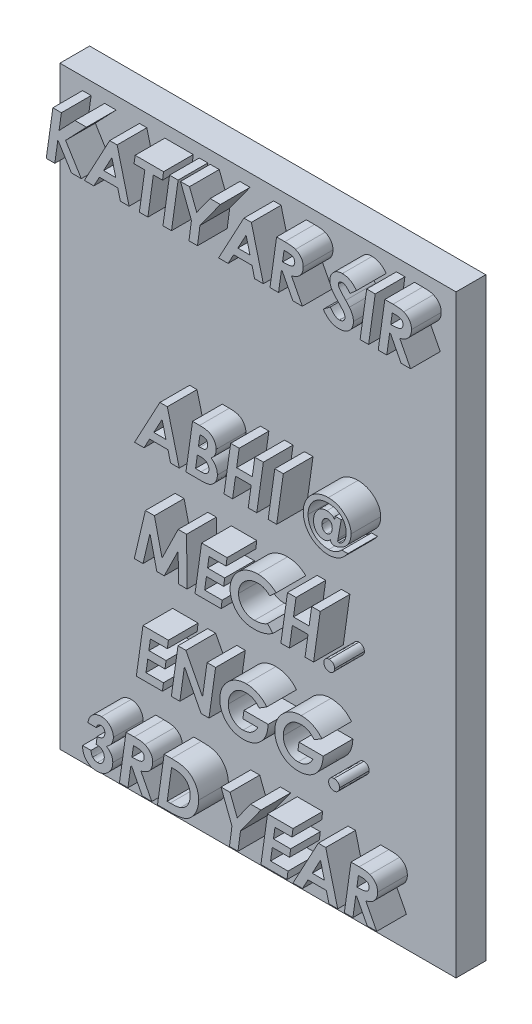
from build123d import *

# Parameters (mm, degrees)
SKETCH1_W           = 20
SKETCH1_H           = 30
BOSS_EXTRUDE2_DEPTH = 1.5
BOSS_EXTRUDE3_DEPTH = 1.5


with BuildPart() as part:
    # Sketch1 → Boss-Extrude2 (new body)
    with BuildSketch(Plane.XY):
        Rectangle(SKETCH1_W, SKETCH1_H)
    extrude(amount=BOSS_EXTRUDE2_DEPTH)

    # Sketch3 → Boss-Extrude3 (add)
    # profile 1 of 32: a face of its own
    with BuildSketch(Plane.XY.offset(1.5)):
        Polygon((-8.855423241, 14.371339041), (-8.424203289, 14.371339041), (-8.541548542, 13.532749799), (-7.739212304, 14.371339041), (-7.159164227, 14.371339041), (-8.212409419, 13.269915514), (-7.419613445, 11.990089041), (-7.918092261, 11.990089041), (-8.603083247, 13.094374648), (-8.758112544, 11.990089041), (-9.189332496, 11.990089041), align=None)
    # profile 2 of 32: a face of its own
    with BuildSketch(Plane.XY.offset(1.5)):
        Polygon((-5.986188716, 14.371339041), (-5.611256324, 14.371339041), (-5.006880573, 11.990089041), (-5.446686763, 11.990089041), (-5.578342412, 12.509079426), (-6.50661014, 12.509079426), (-6.785185861, 11.990089041), (-7.266015188, 11.990089041), align=None)
        Polygon((-5.679946228, 12.905954426), (-5.876475675, 13.68110091), (-6.292908217, 12.905954426), align=None, mode=Mode.SUBTRACT)
    # profile 3 of 32: a face of its own
    with BuildSketch(Plane.XY.offset(1.5)):
        Polygon((-4.701592111, 14.371339041), (-3.266736342, 14.371339041), (-3.31825377, 13.974464041), (-3.781910621, 13.974464041), (-4.057147249, 11.990089041), (-4.487890188, 11.990089041), (-4.213130573, 13.974464041), (-4.756448632, 13.974464041), align=None)
    # profile 4 of 32: a face of its own
    with BuildSketch(Plane.XY.offset(1.5)):
        Polygon((-2.963355933, 14.371339041), (-2.532135981, 14.371339041), (-2.866045236, 11.990089041), (-3.297265188, 11.990089041), align=None)
    # profile 5 of 32: a face of its own
    with BuildSketch(Plane.XY.offset(1.5)):
        Polygon((-2.41192865, 14.371339041), (-1.956381023, 14.371339041), (-1.592896949, 13.430668969), (-0.915538175, 14.371339041), (-0.39797883, 14.371339041), (-1.428804401, 12.939345352), (-1.553781865, 11.990089041), (-1.984524804, 11.990089041), (-1.859070326, 12.941730418), align=None)
    # profile 6 of 32: a face of its own
    with BuildSketch(Plane.XY.offset(1.5)):
        Polygon((0.79121513, 14.371339041), (1.166147522, 14.371339041), (1.770523273, 11.990089041), (1.330717083, 11.990089041), (1.199061434, 12.509079426), (0.270793706, 12.509079426), (-0.007782015, 11.990089041), (-0.488611342, 11.990089041), align=None)
        Polygon((1.097457618, 12.905954426), (0.900928171, 13.68110091), (0.484495629, 12.905954426), align=None, mode=Mode.SUBTRACT)
    # profile 7 of 32: a face of its own
    with BuildSketch(Plane.XY.offset(1.5)):
        with BuildLine():
            Line((2.440249836, 14.371339041), (2.853820299, 14.371339041))
            add(Edge.make_bspline(
                [(2.853820299, 14.371339041), (2.884511698, 14.371213619), (2.943688406, 14.370971789), (3.028786436, 14.367532974), (3.106891951, 14.362344862), (3.177912079, 14.355498119), (3.241906115, 14.345998647), (3.29874098, 14.334592628), (3.34877969, 14.321890437), (3.378787728, 14.310086733), (3.392845239, 14.30455719)],
                knots=[0, 0, 0, 0, 1.348808202, 2.600664361, 3.742342956, 4.788858012, 5.735658768, 6.584006912, 7.336666444, 8, 8, 8, 8], degree=3))
            add(Edge.make_bspline(
                [(3.392845239, 14.30455719), (3.408672188, 14.297419992), (3.43961137, 14.283467899), (3.483945415, 14.259818245), (3.525460796, 14.234341149), (3.563469473, 14.206076042), (3.598773544, 14.176213075), (3.631154094, 14.144468213), (3.66035039, 14.11035427), (3.686668843, 14.074483124), (3.710071097, 14.036901171), (3.730159521, 13.997423083), (3.747529633, 13.956383092), (3.761094251, 13.913334611), (3.772368079, 13.868794388), (3.779659582, 13.822481405), (3.784790998, 13.774551884), (3.785212644, 13.742014004), (3.78542712, 13.72546314)],
                knots=[0, 0, 0, 0, 1.116361014, 2.182309107, 3.229450697, 4.24598407, 5.225421932, 6.201651319, 7.158895679, 8.110002388, 9.060669178, 10.002827475, 10.956240434, 11.923213192, 12.902917952, 13.908279153, 14.936015885, 16, 16, 16, 16], degree=3))
            add(Edge.make_bspline(
                [(3.78542712, 13.72546314), (3.784922726, 13.705096163), (3.783926971, 13.664888452), (3.777420501, 13.605596774), (3.765285127, 13.548700253), (3.748942437, 13.49401966), (3.728695156, 13.441200945), (3.702583639, 13.391163192), (3.672401972, 13.343034556), (3.637545227, 13.297446033), (3.598584421, 13.253979423), (3.553598342, 13.215192784), (3.505075681, 13.178477605), (3.45102306, 13.146295478), (3.392927059, 13.116401147), (3.329462592, 13.091072853), (3.261820785, 13.067698748), (3.214391584, 13.056000333), (3.19011462, 13.050012419)],
                knots=[0, 0, 0, 0, 0.995453645, 1.965186658, 2.910129054, 3.83459069, 4.752398018, 5.669942118, 6.588407184, 7.525617038, 8.471772905, 9.435289717, 10.423772802, 11.441988612, 12.505459691, 13.613754905, 14.778583949, 16, 16, 16, 16], degree=3))
            Line((3.19011462, 13.050012419), (3.73963385, 11.990089041))
            Line((3.73963385, 11.990089041), (3.262143616, 11.990089041))
            Line((3.262143616, 11.990089041), (2.724072702, 13.028069811))
            Line((2.724072702, 13.028069811), (2.683526579, 13.028069811))
            Line((2.683526579, 13.028069811), (2.537560533, 11.990089041))
            Line((2.537560533, 11.990089041), (2.106340581, 11.990089041))
            Line((2.106340581, 11.990089041), (2.440249836, 14.371339041))
        make_face()
        with BuildLine():
            add(Edge.make_bspline(
                [(2.739337126, 13.424944811), (2.770029447, 13.425229805), (2.828736137, 13.425774928), (2.912580896, 13.429566655), (2.988189525, 13.435556207), (3.055343969, 13.444115667), (3.114220881, 13.454238411), (3.164570148, 13.466875933), (3.206622549, 13.481901718), (3.241041356, 13.499720798), (3.268922961, 13.520642136), (3.293055688, 13.542968483), (3.313150524, 13.567960357), (3.329730566, 13.595198196), (3.342518205, 13.624738456), (3.35174007, 13.656781269), (3.356838913, 13.691112986), (3.35762275, 13.714793823), (3.358023273, 13.72689418)],
                knots=[0, 0, 0, 0, 1.892208387, 3.619318591, 5.173427176, 6.566868293, 7.791773198, 8.8545744, 9.763297566, 10.539470204, 11.233547833, 11.906251103, 12.5615143, 13.203742025, 13.866659999, 14.539934446, 15.25394049, 16, 16, 16, 16], degree=3))
            add(Edge.make_bspline(
                [(3.358023273, 13.72689418), (3.357504812, 13.740614237), (3.356499068, 13.767229266), (3.347799795, 13.805562585), (3.332924337, 13.840336111), (3.312018908, 13.871217394), (3.285930056, 13.898446981), (3.254103087, 13.920873686), (3.216901677, 13.938527819), (3.182052829, 13.950191369), (3.149066569, 13.956947196), (3.118317018, 13.961486207), (3.081910408, 13.96586619), (3.039737231, 13.96910505), (2.991848184, 13.971247495), (2.938267649, 13.973329342), (2.879103719, 13.974069659), (2.837760746, 13.974328601), (2.816136254, 13.974464041)],
                knots=[0, 0, 0, 0, 0.974340854, 1.890087692, 2.776057671, 3.647490651, 4.526730822, 5.442477659, 6.397820337, 7.445016909, 8.045730266, 8.789007992, 9.653967296, 10.651691253, 11.794598421, 13.061237498, 14.462876682, 16, 16, 16, 16], degree=3))
            Line((2.816136254, 13.974464041), (2.739337126, 13.424944811))
        make_face(mode=Mode.SUBTRACT)
    # profile 8 of 32: a face of its own
    with BuildSketch(Plane.XY.offset(1.5)):
        with BuildLine():
            Line((6.470534541, 14.040291866), (6.139487366, 13.751698867))
            add(Edge.make_bspline(
                [(6.139487366, 13.751698867), (6.122942413, 13.774048547), (6.091234317, 13.816881295), (6.040920074, 13.874331553), (5.992717182, 13.924255135), (5.944162955, 13.964067047), (5.896836408, 13.995635589), (5.850325127, 14.018503194), (5.804367668, 14.032953726), (5.773712147, 14.034682515), (5.758830815, 14.035521734)],
                knots=[0, 0, 0, 0, 1.358515141, 2.603569235, 3.730126198, 4.746094498, 5.666493297, 6.504166865, 7.273866877, 8, 8, 8, 8], degree=3))
            add(Edge.make_bspline(
                [(5.758830815, 14.035521734), (5.744774126, 14.034913178), (5.71774124, 14.033742843), (5.67893733, 14.023765008), (5.643669644, 14.007715045), (5.613390923, 13.984496795), (5.588102172, 13.957727113), (5.569324931, 13.927686535), (5.55838931, 13.894575198), (5.556873475, 13.87166707), (5.556100196, 13.859980868)],
                knots=[0, 0, 0, 0, 1.130304997, 2.173727141, 3.204821236, 4.229135679, 5.225705988, 6.15679035, 7.05971714, 8, 8, 8, 8], degree=3))
            add(Edge.make_bspline(
                [(5.556100196, 13.859980868), (5.556804438, 13.848468315), (5.55828567, 13.824253939), (5.569137956, 13.787545313), (5.585553473, 13.74886717), (5.605297826, 13.715236474), (5.627466481, 13.684698753), (5.650697843, 13.654817823), (5.681031834, 13.619091497), (5.71794318, 13.577110738), (5.761079248, 13.528521338), (5.811558848, 13.47403028), (5.868473074, 13.413279688), (5.908898093, 13.370852297), (5.930078562, 13.348622695)],
                knots=[0, 0, 0, 0, 0.642317819, 1.35098826, 2.122816345, 2.986294386, 3.520967692, 4.229638134, 5.099348126, 6.137609051, 7.351336444, 8.727500291, 10.285391505, 12, 12, 12, 12], degree=3))
            add(Edge.make_bspline(
                [(5.930078562, 13.348622695), (5.941568424, 13.336737003), (5.963615236, 13.31393067), (5.994549835, 13.280622767), (6.022159601, 13.249752666), (6.047651405, 13.222401548), (6.069474022, 13.197157187), (6.088106419, 13.174625234), (6.103924199, 13.155122744), (6.113275836, 13.142889969), (6.117544758, 13.137305838)],
                knots=[0, 0, 0, 0, 1.403722598, 2.693470914, 3.859630393, 4.920438112, 5.867965235, 6.69256451, 7.40316977, 8, 8, 8, 8], degree=3))
            add(Edge.make_bspline(
                [(6.117544758, 13.137305838), (6.134543867, 13.113821361), (6.167330082, 13.068526805), (6.209856238, 12.99965979), (6.245030115, 12.933307741), (6.272669701, 12.868685387), (6.293345938, 12.805085918), (6.30832112, 12.741458034), (6.317754296, 12.677272479), (6.318800537, 12.634088206), (6.31932135, 12.612591295)],
                knots=[0, 0, 0, 0, 1.215130546, 2.343624586, 3.390252636, 4.360992906, 5.286454858, 6.190345157, 7.099163061, 8, 8, 8, 8], degree=3))
            add(Edge.make_bspline(
                [(6.31932135, 12.612591295), (6.318673258, 12.588864744), (6.31739781, 12.542170773), (6.307514651, 12.473661942), (6.29212087, 12.40797296), (6.269166405, 12.345498473), (6.240823246, 12.285558651), (6.204849753, 12.229031212), (6.163466876, 12.174959714), (6.11569272, 12.124621575), (6.06340314, 12.078587576), (6.006465568, 12.038723667), (5.946282604, 12.00474497), (5.882242455, 11.976771373), (5.814540268, 11.955495159), (5.74329682, 11.940362086), (5.668643629, 11.930316806), (5.617509707, 11.929465865), (5.591399175, 11.929031349)],
                knots=[0, 0, 0, 0, 1.018989505, 2.005376454, 2.968035412, 3.912365187, 4.859556873, 5.811049809, 6.78527381, 7.780773345, 8.787785161, 9.773320145, 10.761314359, 11.752515283, 12.770107012, 13.804505292, 14.878913802, 16, 16, 16, 16], degree=3))
            add(Edge.make_bspline(
                [(5.591399175, 11.929031349), (5.571354031, 11.929432993), (5.531672807, 11.930228085), (5.472857969, 11.935507096), (5.41546918, 11.944519055), (5.359590777, 11.95752398), (5.305106084, 11.973762478), (5.251930157, 11.993254009), (5.200196052, 12.016846236), (5.149837513, 12.043925689), (5.100849887, 12.074598276), (5.053527117, 12.10922986), (5.007358622, 12.147152603), (4.962949522, 12.189084732), (4.919362186, 12.233868774), (4.877360039, 12.282523515), (4.837365127, 12.335252878), (4.811976308, 12.372076046), (4.799080214, 12.390780147)],
                knots=[0, 0, 0, 0, 1.003438088, 1.986398949, 2.953471805, 3.909242729, 4.856156023, 5.798037682, 6.742035895, 7.700024963, 8.658509928, 9.632892881, 10.633707184, 11.647385023, 12.688779161, 13.761077638, 14.862753205, 16, 16, 16, 16], degree=3))
            Line((4.799080214, 12.390780147), (5.151592985, 12.667924829))
            add(Edge.make_bspline(
                [(5.151592985, 12.667924829), (5.169151123, 12.640926934), (5.202826517, 12.589146688), (5.257715855, 12.519252532), (5.313675305, 12.459850295), (5.370908056, 12.411170942), (5.429598237, 12.373294659), (5.48932455, 12.346220389), (5.550352808, 12.328806259), (5.591764585, 12.326870408), (5.612387757, 12.325906349)],
                knots=[0, 0, 0, 0, 1.289844872, 2.473840458, 3.555310637, 4.554525788, 5.477014656, 6.343795492, 7.175205895, 8, 8, 8, 8], degree=3))
            add(Edge.make_bspline(
                [(5.612387757, 12.325906349), (5.631416187, 12.326740276), (5.668458628, 12.328363672), (5.721447666, 12.343478611), (5.770063101, 12.366779269), (5.812151389, 12.400048947), (5.847607823, 12.439121963), (5.873381484, 12.483634494), (5.888897858, 12.532405679), (5.890895839, 12.566208471), (5.891917504, 12.583493489)],
                knots=[0, 0, 0, 0, 1.07813582, 2.098795369, 3.104167493, 4.120866408, 5.124778177, 6.083335831, 7.019916046, 8, 8, 8, 8], degree=3))
            add(Edge.make_bspline(
                [(5.891917504, 12.583493489), (5.89142943, 12.597542756), (5.890436596, 12.626121557), (5.880087254, 12.66868655), (5.864727118, 12.71184726), (5.846110183, 12.748324583), (5.82603061, 12.780310397), (5.804766146, 12.809275817), (5.778009352, 12.843274443), (5.744907437, 12.881508267), (5.70681351, 12.92526806), (5.66228419, 12.973015903), (5.612742212, 13.02633191), (5.577170636, 13.062810491), (5.558485263, 13.081972305)],
                knots=[0, 0, 0, 0, 0.82235112, 1.672813781, 2.554588539, 3.50524042, 4.06657461, 4.767804758, 5.610876414, 6.602916144, 7.732569792, 9.01260869, 10.430754915, 12, 12, 12, 12], degree=3))
            add(Edge.make_bspline(
                [(5.558485263, 13.081972305), (5.53870869, 13.102426535), (5.500477413, 13.141967833), (5.446390395, 13.199836259), (5.397670847, 13.253697054), (5.354373936, 13.303606893), (5.316463896, 13.349655494), (5.283284752, 13.391493521), (5.255840736, 13.429672881), (5.240362481, 13.45444456), (5.233162246, 13.465967948)],
                knots=[0, 0, 0, 0, 1.354401886, 2.618275412, 3.770529779, 4.811580489, 5.763301005, 6.60974666, 7.35327647, 8, 8, 8, 8], degree=3))
            add(Edge.make_bspline(
                [(5.233162246, 13.465967948), (5.217085492, 13.49468248), (5.185893813, 13.550393631), (5.153737505, 13.63807777), (5.132782501, 13.724635399), (5.130043162, 13.782432324), (5.12869635, 13.810848507)],
                knots=[0, 0, 0, 0, 1.081804801, 2.098888081, 3.065307629, 4, 4, 4, 4], degree=3))
            add(Edge.make_bspline(
                [(5.12869635, 13.810848507), (5.129179946, 13.829156), (5.130141907, 13.865573023), (5.137067287, 13.91931976), (5.147671111, 13.971875842), (5.164575355, 14.022444086), (5.184070824, 14.072290722), (5.209553823, 14.120105981), (5.238184065, 14.167176246), (5.261153225, 14.196335186), (5.272754343, 14.211062599)],
                knots=[0, 0, 0, 0, 1.012167245, 2.013389743, 2.992947912, 3.971795425, 4.958040075, 5.949133471, 6.964161297, 8, 8, 8, 8], degree=3))
            add(Edge.make_bspline(
                [(5.272754343, 14.211062599), (5.288068824, 14.22881197), (5.318274498, 14.263820125), (5.37053605, 14.308570498), (5.425947826, 14.347224639), (5.485702596, 14.378256123), (5.549113231, 14.402988576), (5.616782812, 14.419771202), (5.688192729, 14.430735221), (5.737163946, 14.431835105), (5.762169908, 14.432396734)],
                knots=[0, 0, 0, 0, 1.010152455, 1.992384693, 2.959065588, 3.919519142, 4.890305168, 5.888624478, 6.921877408, 8, 8, 8, 8], degree=3))
            add(Edge.make_bspline(
                [(5.762169908, 14.432396734), (5.796749326, 14.431189515), (5.864962287, 14.4288081), (5.965313676, 14.410298614), (6.060942694, 14.378923453), (6.152805742, 14.336295205), (6.239411259, 14.280156266), (6.32191589, 14.212294635), (6.400274106, 14.132226611), (6.446678044, 14.071507742), (6.470534541, 14.040291866)],
                knots=[0, 0, 0, 0, 0.984438778, 1.941949542, 2.894274057, 3.844399604, 4.817935388, 5.825099055, 6.88187249, 8, 8, 8, 8], degree=3))
        make_face()
    # profile 9 of 32: a face of its own
    with BuildSketch(Plane.XY.offset(1.5)):
        Polygon((6.989047913, 14.371339041), (7.420267865, 14.371339041), (7.08635861, 11.990089041), (6.655138658, 11.990089041), align=None)
    # profile 10 of 32: a face of its own
    with BuildSketch(Plane.XY.offset(1.5)):
        with BuildLine():
            Line((7.904913297, 14.371339041), (8.31848376, 14.371339041))
            add(Edge.make_bspline(
                [(8.31848376, 14.371339041), (8.34917516, 14.371213619), (8.408351867, 14.370971789), (8.493449897, 14.367532974), (8.571555412, 14.362344862), (8.64257554, 14.355498119), (8.706569577, 14.345998647), (8.763404441, 14.334592628), (8.813443151, 14.321890437), (8.843451189, 14.310086733), (8.8575087, 14.30455719)],
                knots=[0, 0, 0, 0, 1.348808202, 2.600664361, 3.742342956, 4.788858012, 5.735658768, 6.584006912, 7.336666444, 8, 8, 8, 8], degree=3))
            add(Edge.make_bspline(
                [(8.8575087, 14.30455719), (8.87333565, 14.297419992), (8.904274832, 14.283467899), (8.948608876, 14.259818245), (8.990124258, 14.234341149), (9.028132934, 14.206076042), (9.063437006, 14.176213075), (9.095817555, 14.144468213), (9.125013852, 14.11035427), (9.151332304, 14.074483124), (9.174734558, 14.036901171), (9.194822982, 13.997423083), (9.212193095, 13.956383092), (9.225757713, 13.913334611), (9.237031541, 13.868794388), (9.244323044, 13.822481405), (9.24945446, 13.774551884), (9.249876105, 13.742014004), (9.250090581, 13.72546314)],
                knots=[0, 0, 0, 0, 1.116361014, 2.182309107, 3.229450697, 4.24598407, 5.225421932, 6.201651319, 7.158895679, 8.110002388, 9.060669178, 10.002827475, 10.956240434, 11.923213192, 12.902917952, 13.908279153, 14.936015885, 16, 16, 16, 16], degree=3))
            add(Edge.make_bspline(
                [(9.250090581, 13.72546314), (9.249586187, 13.705096163), (9.248590433, 13.664888452), (9.242083963, 13.605596774), (9.229948588, 13.548700253), (9.213605898, 13.49401966), (9.193358618, 13.441200945), (9.1672471, 13.391163192), (9.137065433, 13.343034556), (9.102208688, 13.297446033), (9.063247883, 13.253979423), (9.018261803, 13.215192784), (8.969739143, 13.178477605), (8.915686522, 13.146295478), (8.857590521, 13.116401147), (8.794126053, 13.091072853), (8.726484247, 13.067698748), (8.679055046, 13.056000333), (8.654778081, 13.050012419)],
                knots=[0, 0, 0, 0, 0.995453645, 1.965186658, 2.910129054, 3.83459069, 4.752398018, 5.669942118, 6.588407184, 7.525617038, 8.471772905, 9.435289717, 10.423772802, 11.441988612, 12.505459691, 13.613754905, 14.778583949, 16, 16, 16, 16], degree=3))
            Line((8.654778081, 13.050012419), (9.204297312, 11.990089041))
            Line((9.204297312, 11.990089041), (8.726807077, 11.990089041))
            Line((8.726807077, 11.990089041), (8.188736164, 13.028069811))
            Line((8.188736164, 13.028069811), (8.14819004, 13.028069811))
            Line((8.14819004, 13.028069811), (8.002223995, 11.990089041))
            Line((8.002223995, 11.990089041), (7.571004043, 11.990089041))
            Line((7.571004043, 11.990089041), (7.904913297, 14.371339041))
        make_face()
        with BuildLine():
            add(Edge.make_bspline(
                [(8.204000587, 13.424944811), (8.234692909, 13.425229805), (8.293399599, 13.425774928), (8.377244357, 13.429566655), (8.452852986, 13.435556207), (8.520007431, 13.444115667), (8.578884342, 13.454238411), (8.62923361, 13.466875933), (8.67128601, 13.481901718), (8.705704818, 13.499720798), (8.733586422, 13.520642136), (8.757719149, 13.542968483), (8.777813986, 13.567960357), (8.794394027, 13.595198196), (8.807181667, 13.624738456), (8.816403532, 13.656781269), (8.821502374, 13.691112986), (8.822286212, 13.714793823), (8.822686735, 13.72689418)],
                knots=[0, 0, 0, 0, 1.892208387, 3.619318591, 5.173427176, 6.566868293, 7.791773198, 8.8545744, 9.763297566, 10.539470204, 11.233547833, 11.906251103, 12.5615143, 13.203742025, 13.866659999, 14.539934446, 15.25394049, 16, 16, 16, 16], degree=3))
            add(Edge.make_bspline(
                [(8.822686735, 13.72689418), (8.822168274, 13.740614237), (8.82116253, 13.767229266), (8.812463256, 13.805562585), (8.797587798, 13.840336111), (8.776682369, 13.871217394), (8.750593517, 13.898446981), (8.718766548, 13.920873686), (8.681565138, 13.938527819), (8.646716291, 13.950191369), (8.61373003, 13.956947196), (8.582980479, 13.961486207), (8.54657387, 13.96586619), (8.504400693, 13.96910505), (8.456511646, 13.971247495), (8.402931111, 13.973329342), (8.34376718, 13.974069659), (8.302424208, 13.974328601), (8.280799716, 13.974464041)],
                knots=[0, 0, 0, 0, 0.974340854, 1.890087692, 2.776057671, 3.647490651, 4.526730822, 5.442477659, 6.397820337, 7.445016909, 8.045730266, 8.789007992, 9.653967296, 10.651691253, 11.794598421, 13.061237498, 14.462876682, 16, 16, 16, 16], degree=3))
            Line((8.280799716, 13.974464041), (8.204000587, 13.424944811))
        make_face(mode=Mode.SUBTRACT)
    # profile 11 of 32: a face of its own
    with BuildSketch(Plane.XY.offset(1.5)):
        Polygon((-3.452294485, 4.189608272), (-3.077362093, 4.189608272), (-2.472986342, 1.808358272), (-2.912792532, 1.808358272), (-3.044448181, 2.327348657), (-3.972715909, 2.327348657), (-4.25129163, 1.808358272), (-4.732120957, 1.808358272), align=None)
        Polygon((-3.146051997, 2.724223657), (-3.342581444, 3.499370141), (-3.759013986, 2.724223657), align=None, mode=Mode.SUBTRACT)
    # profile 12 of 32: a face of its own
    with BuildSketch(Plane.XY.offset(1.5)):
        with BuildLine():
            Line((-1.803259779, 4.189608272), (-1.44645389, 4.189608272))
            add(Edge.make_bspline(
                [(-1.44645389, 4.189608272), (-1.420212291, 4.189527614), (-1.369447308, 4.189371578), (-1.295956913, 4.185282709), (-1.227560312, 4.179576908), (-1.164249342, 4.172466758), (-1.106375131, 4.16171208), (-1.053579382, 4.149493865), (-1.005925169, 4.135025736), (-0.949948204, 4.112016343), (-0.886729204, 4.076937073), (-0.817684891, 4.025694351), (-0.758071598, 3.962497691), (-0.705839715, 3.891537624), (-0.663381857, 3.813814107), (-0.633291297, 3.73147004), (-0.61430996, 3.646196088), (-0.61192643, 3.58819202), (-0.610726727, 3.558996794)],
                knots=[0, 0, 0, 0, 1.060182399, 2.050947427, 2.972933909, 3.833603532, 4.623758792, 5.349968742, 6.022619805, 6.633490032, 7.792338899, 8.934684725, 10.0933911, 11.288487101, 12.487324871, 13.658169267, 14.821284765, 16, 16, 16, 16], degree=3))
            add(Edge.make_bspline(
                [(-0.610726727, 3.558996794), (-0.61161814, 3.534465574), (-0.613382591, 3.485908825), (-0.625505342, 3.414084151), (-0.646313862, 3.344549007), (-0.674681529, 3.277510613), (-0.711020327, 3.214375547), (-0.754782657, 3.156124563), (-0.806002222, 3.103280245), (-0.844878671, 3.072958059), (-0.86449776, 3.057655898)],
                knots=[0, 0, 0, 0, 1.008802286, 1.996808917, 2.985853824, 3.987935791, 4.984003692, 5.974085787, 6.977617699, 8, 8, 8, 8], degree=3))
            add(Edge.make_bspline(
                [(-0.86449776, 3.057655898), (-0.839381728, 3.038984352), (-0.790330052, 3.002518773), (-0.726201783, 2.939425455), (-0.67178631, 2.872207614), (-0.626618726, 2.800565333), (-0.592369534, 2.723643603), (-0.567387781, 2.642493706), (-0.552151337, 2.556727799), (-0.550507734, 2.498023345), (-0.549669034, 2.468067557)],
                knots=[0, 0, 0, 0, 1.076867414, 2.103124847, 3.088410714, 4.050300241, 5.011160291, 5.979497965, 6.968975523, 8, 8, 8, 8], degree=3))
            add(Edge.make_bspline(
                [(-0.549669034, 2.468067557), (-0.550838585, 2.43681091), (-0.553151322, 2.37500222), (-0.572299805, 2.284441574), (-0.604155139, 2.198091626), (-0.648106918, 2.117364417), (-0.700243518, 2.043438371), (-0.760030692, 1.979360117), (-0.825274908, 1.925361682), (-0.885044541, 1.888601639), (-0.937116988, 1.865167664), (-0.980226308, 1.850002582), (-1.027388248, 1.836996082), (-1.078792179, 1.826943011), (-1.134105037, 1.818016795), (-1.193564492, 1.812812649), (-1.257018614, 1.808566301), (-1.300797377, 1.808429073), (-1.323384479, 1.808358272)],
                knots=[0, 0, 0, 0, 1.303747164, 2.57810456, 3.844347155, 5.133141427, 6.403898642, 7.610790585, 8.780141826, 9.92981316, 10.526901919, 11.160883678, 11.835562906, 12.567100275, 13.346228134, 14.173084326, 15.057425816, 16, 16, 16, 16], degree=3))
            Line((-1.323384479, 1.808358272), (-2.137169034, 1.808358272))
            Line((-2.137169034, 1.808358272), (-1.803259779, 4.189608272))
        make_face()
        with BuildLine():
            Line((-1.505603529, 3.243214041), (-1.427373361, 3.243214041))
            add(Edge.make_bspline(
                [(-1.427373361, 3.243214041), (-1.413219343, 3.243276923), (-1.386175559, 3.243397071), (-1.347546744, 3.245074185), (-1.312338198, 3.246566212), (-1.280884507, 3.25013094), (-1.252655928, 3.253733676), (-1.228205996, 3.258622399), (-1.206891524, 3.263352282), (-1.183713897, 3.272731821), (-1.15728967, 3.286698388), (-1.129486946, 3.310526586), (-1.103533088, 3.339187153), (-1.080976849, 3.373549141), (-1.062003258, 3.411760127), (-1.048180609, 3.452823132), (-1.039797593, 3.49601095), (-1.038693381, 3.525409213), (-1.038130573, 3.540393278)],
                knots=[0, 0, 0, 0, 1.199333927, 2.291542006, 3.276678834, 4.184405191, 4.973343612, 5.686872737, 6.298011521, 6.818495195, 7.801417815, 8.815884106, 9.903594398, 11.069613373, 12.286904311, 13.509850177, 14.730790054, 16, 16, 16, 16], degree=3))
            add(Edge.make_bspline(
                [(-1.038130573, 3.540393278), (-1.038577149, 3.554097153), (-1.039450769, 3.580905487), (-1.046556554, 3.619494989), (-1.05872877, 3.655125596), (-1.075343827, 3.687396047), (-1.095635477, 3.715953342), (-1.119265653, 3.740004655), (-1.14651271, 3.758239297), (-1.171869169, 3.769748489), (-1.195160671, 3.776653132), (-1.216770089, 3.780670701), (-1.242223513, 3.784497294), (-1.271648191, 3.787827618), (-1.305068573, 3.790144815), (-1.342457478, 3.791409248), (-1.383801319, 3.792392564), (-1.412744288, 3.79261643), (-1.427850374, 3.792733272)],
                knots=[0, 0, 0, 0, 1.217888189, 2.382505203, 3.473394342, 4.554621668, 5.598222957, 6.577909812, 7.534682879, 8.496456537, 9.042175867, 9.690967717, 10.448749248, 11.330850431, 12.323004962, 13.426554395, 14.656852007, 16, 16, 16, 16], degree=3))
            Line((-1.427850374, 3.792733272), (-1.505603529, 3.243214041))
        make_face(mode=Mode.SUBTRACT)
        with BuildLine():
            Line((-1.650138536, 2.205233272), (-1.374424894, 2.195693008))
            add(Edge.make_bspline(
                [(-1.374424894, 2.195693008), (-1.357721277, 2.195981444), (-1.32538214, 2.196539874), (-1.278558662, 2.200429741), (-1.235148543, 2.206366582), (-1.195326953, 2.215262115), (-1.159440571, 2.227474827), (-1.126594451, 2.241069741), (-1.097264755, 2.257692479), (-1.071754836, 2.277649012), (-1.049450758, 2.299490913), (-1.029890927, 2.323209682), (-1.01389354, 2.349020668), (-1.000171513, 2.376558179), (-0.989938264, 2.406103245), (-0.982022711, 2.437499335), (-0.977913116, 2.470819166), (-0.977356171, 2.49365772), (-0.97707288, 2.505274588)],
                knots=[0, 0, 0, 0, 1.396545255, 2.703789819, 3.925918336, 5.057947269, 6.109009747, 7.09185152, 8.026860065, 8.917724649, 9.79206713, 10.633022212, 11.481406092, 12.325717456, 13.200363125, 14.090334412, 15.028645384, 16, 16, 16, 16], degree=3))
            add(Edge.make_bspline(
                [(-0.97707288, 2.505274588), (-0.977860944, 2.52249448), (-0.979401214, 2.556150734), (-0.989957148, 2.605473885), (-1.009038826, 2.651394052), (-1.034237228, 2.694398703), (-1.065395953, 2.73293531), (-1.10243877, 2.765486864), (-1.144183862, 2.791772248), (-1.183132525, 2.808750481), (-1.218555929, 2.819654393), (-1.251257033, 2.825766367), (-1.289193418, 2.832269873), (-1.332893812, 2.836523481), (-1.381824896, 2.841149577), (-1.436418071, 2.843679905), (-1.496526329, 2.845661506), (-1.538515396, 2.846106484), (-1.56046005, 2.846339041)],
                knots=[0, 0, 0, 0, 1.072622611, 2.096439365, 3.122744367, 4.15723709, 5.19210906, 6.195602288, 7.215049995, 8.252903698, 8.832552919, 9.520188734, 10.322946655, 11.229686895, 12.253743166, 13.384425235, 14.63302787, 16, 16, 16, 16], degree=3))
            Line((-1.56046005, 2.846339041), (-1.650138536, 2.205233272))
        make_face(mode=Mode.SUBTRACT)
    # profile 13 of 32: a face of its own
    with BuildSketch(Plane.XY.offset(1.5)):
        Polygon((0.120057528, 4.189608272), (0.55127748, 4.189608272), (0.422960924, 3.273742888), (1.213371831, 3.273742888), (1.341211374, 4.189608272), (1.772431326, 4.189608272), (1.438522071, 1.808358272), (1.00730212, 1.808358272), (1.157084271, 2.876867888), (0.367150377, 2.876867888), (0.217368225, 1.808358272), (-0.213851727, 1.808358272), align=None)
    # profile 14 of 32: a face of its own
    with BuildSketch(Plane.XY.offset(1.5)):
        Polygon((2.348663297, 4.189608272), (2.779883249, 4.189608272), (2.445973995, 1.808358272), (2.014754043, 1.808358272), align=None)
    # profile 15 of 32: a face of its own
    with BuildSketch(Plane.XY.offset(1.5)):
        with BuildLine():
            Line((5.735457168, 2.327348657), (6.039314589, 2.327348657))
            add(Edge.make_bspline(
                [(6.039314589, 2.327348657), (6.025039615, 2.309194883), (5.997210946, 2.273804602), (5.956043555, 2.222653484), (5.915329138, 2.175993833), (5.876112717, 2.13282923), (5.838258623, 2.093370691), (5.801391657, 2.057824354), (5.765663952, 2.026399174), (5.719753016, 1.989255386), (5.66015081, 1.948164195), (5.584221639, 1.90472251), (5.502686877, 1.866869955), (5.416266876, 1.835382001), (5.326491255, 1.809347736), (5.234036903, 1.791484382), (5.139794242, 1.780075454), (5.076257642, 1.778581618), (5.04426501, 1.777829426)],
                knots=[0, 0, 0, 0, 0.935044915, 1.822844292, 2.657988685, 3.441806477, 4.183934045, 4.871445691, 5.514606307, 6.109808703, 7.261657841, 8.441044826, 9.647856416, 10.896393371, 12.161811678, 13.428146695, 14.704992789, 16, 16, 16, 16], degree=3))
            add(Edge.make_bspline(
                [(5.04426501, 1.777829426), (5.015938503, 1.778183931), (4.959801166, 1.778886489), (4.876541651, 1.787670307), (4.794674748, 1.800062396), (4.714515701, 1.819107015), (4.635674789, 1.842212921), (4.558601338, 1.871078115), (4.483066568, 1.90499684), (4.409548634, 1.944026908), (4.338437268, 1.987196506), (4.271370181, 2.034947411), (4.208034439, 2.08615561), (4.14876344, 2.141149988), (4.093294685, 2.19994558), (4.041722621, 2.262611213), (3.993823315, 2.328903156), (3.950858374, 2.399011207), (3.911403764, 2.471128931), (3.878331599, 2.545879396), (3.849337522, 2.621855937), (3.826085205, 2.699688236), (3.807817978, 2.779033469), (3.795223868, 2.859867269), (3.786495019, 2.942186529), (3.785785278, 2.997688095), (3.78542712, 3.025696013)],
                knots=[0, 0, 0, 0, 1.033627215, 2.048437506, 3.053321743, 4.054426786, 5.053527276, 6.050855696, 7.056326531, 8.074186796, 9.087618279, 10.091009337, 11.077331105, 12.058996025, 13.040386324, 14.025887894, 15.019832203, 16.023374357, 17.025875162, 18.01837773, 19.004836131, 19.992813303, 20.981301895, 21.974720635, 22.977977366, 24, 24, 24, 24], degree=3))
            add(Edge.make_bspline(
                [(3.78542712, 3.025696013), (3.786068312, 3.053852677), (3.787345732, 3.109947915), (3.794804835, 3.193363027), (3.808567974, 3.275140594), (3.82631145, 3.355629741), (3.850639784, 3.434283121), (3.878836872, 3.511874058), (3.913833037, 3.587324241), (3.952475032, 3.661502828), (3.996114155, 3.732890946), (4.044618018, 3.800061924), (4.095993757, 3.863806065), (4.151506828, 3.92307702), (4.210960984, 3.978229414), (4.274324649, 4.029125013), (4.341467908, 4.0760357), (4.411786483, 4.118943287), (4.485247453, 4.156844691), (4.560390251, 4.190544377), (4.637943012, 4.217987382), (4.71673767, 4.241740005), (4.797695003, 4.259049467), (4.880140859, 4.272163979), (4.964453263, 4.279922999), (5.021352747, 4.280769023), (5.049989169, 4.281194811)],
                knots=[0, 0, 0, 0, 1.020928548, 2.033949389, 3.032831442, 4.025757338, 5.019636612, 6.015503329, 7.016429294, 8.032381852, 9.046763145, 10.046592897, 11.034233531, 12.013069876, 12.987977151, 13.971994084, 14.957124827, 15.955657502, 16.956052119, 17.952252471, 18.938748444, 19.936498732, 20.933799287, 21.937460549, 22.961963333, 24, 24, 24, 24], degree=3))
            add(Edge.make_bspline(
                [(5.049989169, 4.281194811), (5.089468175, 4.280316993), (5.167103087, 4.278590777), (5.281232491, 4.263804867), (5.390688951, 4.240264877), (5.495424803, 4.206535843), (5.595420624, 4.163708833), (5.690468237, 4.110657943), (5.780959434, 4.048491087), (5.865433344, 3.977380435), (5.942682258, 3.900288778), (6.010734241, 3.819157208), (6.068558506, 3.734790268), (6.115654978, 3.647015127), (6.152176671, 3.555966962), (6.177800661, 3.461834165), (6.194322872, 3.364796857), (6.196237824, 3.29893263), (6.197205966, 3.265633663)],
                knots=[0, 0, 0, 0, 1.11458403, 2.191813891, 3.24439759, 4.272587737, 5.29445286, 6.311600447, 7.341720659, 8.390465671, 9.425633967, 10.42032874, 11.37690911, 12.309114747, 13.228062787, 14.141022409, 15.060156958, 16, 16, 16, 16], degree=3))
            add(Edge.make_bspline(
                [(6.197205966, 3.265633663), (6.196728541, 3.241290107), (6.195787479, 3.193306035), (6.188915883, 3.122563344), (6.178140156, 3.054484301), (6.162788724, 2.988920949), (6.142810839, 2.926095579), (6.118292874, 2.865719713), (6.089867602, 2.807733627), (6.056171094, 2.753116527), (6.019452444, 2.700950261), (5.979301431, 2.651668782), (5.935731003, 2.605531085), (5.889549958, 2.561581846), (5.839049763, 2.522080865), (5.786666892, 2.483722862), (5.730244266, 2.449600053), (5.690893718, 2.429211412), (5.671060383, 2.418935195)],
                knots=[0, 0, 0, 0, 1.107581146, 2.183175413, 3.231110501, 4.241973379, 5.244202913, 6.227688662, 7.204873372, 8.178946022, 9.144517217, 10.106149783, 11.068462573, 12.030775364, 13.003664972, 13.983524561, 14.983662629, 16, 16, 16, 16], degree=3))
            add(Edge.make_bspline(
                [(5.671060383, 2.418935195), (5.641386962, 2.405044589), (5.585598369, 2.378929049), (5.503449453, 2.350021334), (5.42878336, 2.331277117), (5.380967104, 2.3286), (5.358616723, 2.327348657)],
                knots=[0, 0, 0, 0, 1.197607085, 2.251604667, 3.182761159, 4, 4, 4, 4], degree=3))
            add(Edge.make_bspline(
                [(5.358616723, 2.327348657), (5.343458583, 2.327995941), (5.314596022, 2.329228433), (5.273527168, 2.338372016), (5.236896993, 2.353897169), (5.216501527, 2.369664183), (5.206449505, 2.377435045)],
                knots=[0, 0, 0, 0, 1.111040528, 2.115528298, 3.071227409, 4, 4, 4, 4], degree=3))
            add(Edge.make_bspline(
                [(5.206449505, 2.377435045), (5.199486859, 2.384090943), (5.18496444, 2.397973557), (5.171111975, 2.427033778), (5.162056147, 2.461651038), (5.160215081, 2.486918771), (5.159225196, 2.500504456)],
                knots=[0, 0, 0, 0, 0.84582962, 1.764198658, 2.79787821, 4, 4, 4, 4], degree=3))
            add(Edge.make_bspline(
                [(5.159225196, 2.500504456), (5.147718577, 2.48675319), (5.12523435, 2.459882867), (5.08789053, 2.424432419), (5.048482134, 2.394580826), (5.007211777, 2.370075768), (4.964080807, 2.350681173), (4.918794963, 2.337450421), (4.871739666, 2.329026493), (4.839662332, 2.327912929), (4.823407889, 2.327348657)],
                knots=[0, 0, 0, 0, 1.097876945, 2.145279488, 3.146733727, 4.120757491, 5.080203574, 6.035684987, 7.004629062, 8, 8, 8, 8], degree=3))
            add(Edge.make_bspline(
                [(4.823407889, 2.327348657), (4.805252173, 2.327752354), (4.769410435, 2.328549304), (4.717016324, 2.336477972), (4.66674445, 2.348785966), (4.619009964, 2.366614061), (4.573274105, 2.389028279), (4.530280946, 2.417000652), (4.489394225, 2.449604909), (4.451443371, 2.487265227), (4.416864569, 2.528906782), (4.386349724, 2.574141038), (4.361239025, 2.622919809), (4.340508725, 2.675015291), (4.324563418, 2.730336673), (4.312284322, 2.788952521), (4.305909168, 2.85096688), (4.304921315, 2.893391913), (4.304417504, 2.915028945)],
                knots=[0, 0, 0, 0, 0.989896784, 1.954184632, 2.88414738, 3.80912, 4.728584473, 5.657413614, 6.601710579, 7.577056023, 8.568927438, 9.550579391, 10.547747686, 11.556172752, 12.60480347, 13.685141444, 14.819407664, 16, 16, 16, 16], degree=3))
            add(Edge.make_bspline(
                [(4.304417504, 2.915028945), (4.304941806, 2.939226015), (4.305976551, 2.986980635), (4.31499979, 3.057638319), (4.328905647, 3.126412048), (4.349999033, 3.193041099), (4.375477301, 3.258009328), (4.407187971, 3.320964874), (4.445188704, 3.381436648), (4.487685411, 3.439763481), (4.534546696, 3.494193261), (4.587163725, 3.540876414), (4.642496789, 3.581603141), (4.702286942, 3.614156513), (4.765690001, 3.639586613), (4.832892045, 3.657821065), (4.904012949, 3.668283007), (4.952644383, 3.669828512), (4.977483159, 3.670617888)],
                knots=[0, 0, 0, 0, 1.02965226, 2.032091177, 3.027719829, 4.012568104, 5.003029418, 5.995916269, 7.008292387, 8.039922847, 9.066366349, 10.058514617, 11.027936689, 11.985183432, 12.947989992, 13.929903074, 14.942686414, 16, 16, 16, 16], degree=3))
            add(Edge.make_bspline(
                [(4.977483159, 3.670617888), (4.997873364, 3.670139604), (5.037753468, 3.669204156), (5.095644989, 3.659819155), (5.150323072, 3.645125151), (5.201497064, 3.62392757), (5.249653738, 3.597247736), (5.293825207, 3.56392353), (5.334409659, 3.524484026), (5.357703219, 3.494272869), (5.369588027, 3.478858573)],
                knots=[0, 0, 0, 0, 1.075930886, 2.104355303, 3.088214765, 4.059634643, 5.021976484, 5.987572886, 6.973222161, 8, 8, 8, 8], degree=3))
            Line((5.369588027, 3.478858573), (5.401547913, 3.640089041))
            Line((5.401547913, 3.640089041), (5.702066242, 3.640089041))
            Line((5.702066242, 3.640089041), (5.5417898, 2.728039763))
            add(Edge.make_bspline(
                [(5.5417898, 2.728039763), (5.539269582, 2.713749051), (5.534823574, 2.688538292), (5.53071897, 2.65580291), (5.526585644, 2.633676584), (5.525834444, 2.622308264), (5.52557135, 2.618326722)],
                knots=[0, 0, 0, 0, 1.56926094, 2.768389796, 3.568651426, 4, 4, 4, 4], degree=3))
            add(Edge.make_bspline(
                [(5.52557135, 2.618326722), (5.526526482, 2.612552583), (5.528571337, 2.60019065), (5.542186392, 2.585149791), (5.560426301, 2.57378571), (5.575009813, 2.57231716), (5.582335924, 2.571579426)],
                knots=[0, 0, 0, 0, 0.858643381, 1.838281551, 2.914048429, 4, 4, 4, 4], degree=3))
            add(Edge.make_bspline(
                [(5.582335924, 2.571579426), (5.592790604, 2.572685344), (5.616086554, 2.575149638), (5.652010334, 2.591303344), (5.692697359, 2.614938448), (5.737209668, 2.647432379), (5.782739825, 2.688567423), (5.824124414, 2.739850012), (5.861478548, 2.798872429), (5.893471659, 2.865545613), (5.920104196, 2.937806611), (5.939130051, 3.014735721), (5.950846593, 3.094978113), (5.952259529, 3.149679406), (5.952975196, 3.177386217)],
                knots=[0, 0, 0, 0, 0.492479061, 1.097380994, 1.832093856, 2.71134684, 3.686578155, 4.71348579, 5.804161798, 6.969676197, 8.189749934, 9.424784652, 10.695624892, 12, 12, 12, 12], degree=3))
            add(Edge.make_bspline(
                [(5.952975196, 3.177386217), (5.952581386, 3.19806815), (5.951801597, 3.239020794), (5.94643519, 3.299385858), (5.937984008, 3.358064448), (5.925534171, 3.414604008), (5.909790295, 3.469488757), (5.890161982, 3.522344497), (5.867254342, 3.573518783), (5.840949785, 3.622768381), (5.811494223, 3.669802786), (5.779051877, 3.714486281), (5.742827266, 3.75612029), (5.703952372, 3.79565715), (5.661832862, 3.832453586), (5.616692985, 3.866529178), (5.568435168, 3.897850548), (5.517651467, 3.927064315), (5.463924793, 3.952624591), (5.40858225, 3.975799855), (5.350764208, 3.994013768), (5.291554685, 4.010269397), (5.229891483, 4.021634167), (5.166640716, 4.031210472), (5.10125005, 4.035603071), (5.057148346, 4.036505301), (5.034724746, 4.036964041)],
                knots=[0, 0, 0, 0, 1.05302492, 2.085112361, 3.083561307, 4.069756449, 5.030634419, 5.988677078, 6.938163005, 7.88353222, 8.829282723, 9.762052268, 10.692041779, 11.636682653, 12.583403014, 13.537159721, 14.514004932, 15.511205693, 16.517892913, 17.541786398, 18.563372514, 19.602265175, 20.666128111, 21.753876413, 22.857953964, 24, 24, 24, 24], degree=3))
            add(Edge.make_bspline(
                [(5.034724746, 4.036964041), (5.011176771, 4.036652434), (4.964632474, 4.03603652), (4.895681861, 4.029466095), (4.828605666, 4.019632491), (4.763230043, 4.005786999), (4.699847467, 3.987617446), (4.638089507, 3.965500684), (4.577924691, 3.940052917), (4.520332459, 3.909724131), (4.464937755, 3.876456465), (4.41219621, 3.839657841), (4.362754651, 3.799146331), (4.3162545, 3.755307822), (4.272177828, 3.708944934), (4.232196364, 3.658196157), (4.194306561, 3.604984545), (4.160151172, 3.548320736), (4.129748152, 3.489271088), (4.103039487, 3.428564788), (4.079817799, 3.366614072), (4.061939403, 3.302838493), (4.047559715, 3.237865346), (4.036982686, 3.171307683), (4.030656357, 3.103255812), (4.029991836, 3.057351125), (4.029657889, 3.034282251)],
                knots=[0, 0, 0, 0, 1.067369209, 2.109733396, 3.137460048, 4.139970581, 5.137178988, 6.124540252, 7.112822279, 8.09630692, 9.073056921, 10.041067748, 11.009400673, 11.96826754, 12.937324793, 13.906730604, 14.894828547, 15.897546435, 16.903550362, 17.904192765, 18.903249712, 19.90045812, 20.90449689, 21.919066429, 22.954250697, 24, 24, 24, 24], degree=3))
            add(Edge.make_bspline(
                [(4.029657889, 3.034282251), (4.02991249, 3.010728012), (4.0304176, 2.963998133), (4.037874241, 2.894810921), (4.047175907, 2.826925414), (4.062452297, 2.761107382), (4.080722953, 2.696673343), (4.104534447, 2.6345275), (4.130970211, 2.573297434), (4.16269661, 2.514672093), (4.197107688, 2.457693213), (4.236033063, 2.404496961), (4.277463753, 2.353868615), (4.323125033, 2.307366995), (4.371239924, 2.263205582), (4.422975359, 2.222410651), (4.478488711, 2.185530576), (4.536510155, 2.150945795), (4.597331312, 2.12068162), (4.660277331, 2.094264996), (4.724942541, 2.071847985), (4.791464781, 2.053878895), (4.859559275, 2.03922669), (4.929569101, 2.029606458), (5.001365195, 2.02297717), (5.049814615, 2.022368179), (5.074316843, 2.022060195)],
                knots=[0, 0, 0, 0, 1.040495556, 2.064266685, 3.073069451, 4.06707597, 5.047877167, 6.030816202, 7.006264963, 7.993465785, 8.974594247, 9.945983907, 10.904294675, 11.863506947, 12.823645596, 13.789528409, 14.771914567, 15.767485025, 16.773223191, 17.77171634, 18.7829641, 19.795676022, 20.81565302, 21.859229427, 22.917352382, 24, 24, 24, 24], degree=3))
            add(Edge.make_bspline(
                [(5.074316843, 2.022060195), (5.103156259, 2.022801283), (5.160198896, 2.02426711), (5.244335584, 2.038548423), (5.326359282, 2.059640008), (5.406879706, 2.090817899), (5.487170386, 2.13277542), (5.568761126, 2.186173585), (5.652562769, 2.251577221), (5.70701916, 2.301354275), (5.735457168, 2.327348657)],
                knots=[0, 0, 0, 0, 0.924681126, 1.828963882, 2.731185765, 3.638959835, 4.592882594, 5.633103107, 6.763968189, 8, 8, 8, 8], degree=3))
        make_face()
        with BuildLine():
            add(Edge.make_bspline(
                [(4.966511855, 2.663165965), (4.97655155, 2.663558062), (4.996292684, 2.664329046), (5.025352601, 2.669699515), (5.053141343, 2.678758901), (5.079641449, 2.691771686), (5.104451451, 2.708711619), (5.128145167, 2.728869359), (5.149936542, 2.753086638), (5.177945055, 2.789150443), (5.206873601, 2.839633788), (5.232564872, 2.904484348), (5.247725023, 2.973488742), (5.249768927, 3.020692841), (5.250811735, 3.044776541)],
                knots=[0, 0, 0, 0, 0.687183452, 1.351214468, 2.015602298, 2.682571321, 3.364909299, 4.067441173, 4.807031853, 5.590881759, 7.190939536, 8.769711716, 10.351895353, 12, 12, 12, 12], degree=3))
            add(Edge.make_bspline(
                [(5.250811735, 3.044776541), (5.249946285, 3.065177288), (5.248280488, 3.104444127), (5.236722409, 3.160739997), (5.215132179, 3.210576455), (5.186826341, 3.254148324), (5.151904587, 3.289635127), (5.112312954, 3.316483591), (5.067406508, 3.331672868), (5.036262641, 3.333745747), (5.020414349, 3.33480058)],
                knots=[0, 0, 0, 0, 1.185560342, 2.281936405, 3.316788132, 4.323880474, 5.284287175, 6.191441787, 7.079672483, 8, 8, 8, 8], degree=3))
            add(Edge.make_bspline(
                [(5.020414349, 3.33480058), (5.010863055, 3.334342791), (4.991963367, 3.333436937), (4.963864817, 3.328946886), (4.937318472, 3.319493686), (4.911301922, 3.307386808), (4.886467715, 3.291673195), (4.861955717, 3.272891676), (4.83952803, 3.249744804), (4.810039167, 3.215489327), (4.778704371, 3.166798511), (4.751088694, 3.101889284), (4.734548366, 3.030968086), (4.732744937, 2.981740128), (4.73182135, 2.956529096)],
                knots=[0, 0, 0, 0, 0.65503616, 1.296157165, 1.94032477, 2.578663521, 3.258762279, 3.949507837, 4.68895526, 5.461673885, 7.044923617, 8.631168385, 10.274725843, 12, 12, 12, 12], degree=3))
            add(Edge.make_bspline(
                [(4.73182135, 2.956529096), (4.732669989, 2.935489352), (4.734298578, 2.895112804), (4.745964999, 2.837510796), (4.766793818, 2.78672556), (4.794718065, 2.742637023), (4.830386365, 2.707648805), (4.87110389, 2.681414085), (4.917466357, 2.666182224), (4.949866229, 2.664189657), (4.966511855, 2.663165965)],
                knots=[0, 0, 0, 0, 1.199174487, 2.301288879, 3.329679424, 4.312653151, 5.254789388, 6.155011896, 7.052126397, 8, 8, 8, 8], degree=3))
        make_face(mode=Mode.SUBTRACT)
    # profile 16 of 32: a face of its own
    with BuildSketch(Plane.XY.offset(1.5)):
        Polygon((-4.183555753, -0.901257112), (-3.728962153, -0.901257112), (-3.343058457, -2.560309096), (-2.528319876, -0.901257112), (-2.106640188, -0.901257112), (-2.076111342, -3.282507112), (-2.503515188, -3.282507112), (-2.534044034, -1.858145634), (-3.233345417, -3.282507112), (-3.605892742, -3.282507112), (-3.95363538, -1.786593651), (-4.305194124, -3.282507112), (-4.743092261, -3.282507112), align=None)
    # profile 17 of 32: a face of its own
    with BuildSketch(Plane.XY.offset(1.5)):
        Polygon((-1.345327087, -0.901257112), (-0.061207496, -0.901257112), (-0.111293884, -1.298132112), (-0.969440669, -1.298132112), (-1.046716811, -1.847651343), (-0.180460801, -1.847651343), (-0.231024203, -2.244526343), (-1.102527358, -2.244526343), (-1.192205843, -2.885632112), (-0.311639437, -2.885632112), (-0.361725825, -3.282507112), (-1.679236342, -3.282507112), align=None)
    # profile 18 of 32: a face of its own
    with BuildSketch(Plane.XY.offset(1.5)):
        with BuildLine():
            Line((2.416399175, -1.200821415), (2.086783039, -1.496092599))
            add(Edge.make_bspline(
                [(2.086783039, -1.496092599), (2.068491198, -1.476050839), (2.031979433, -1.436046114), (1.968714992, -1.384673753), (1.900170052, -1.33995924), (1.826033542, -1.302836606), (1.747427746, -1.273186879), (1.665027385, -1.252294717), (1.579321631, -1.239539818), (1.521089781, -1.237905636), (1.491470539, -1.23707442)],
                knots=[0, 0, 0, 0, 0.971056601, 1.938295404, 2.910103745, 3.898650509, 4.902833105, 5.914277838, 6.939111328, 8, 8, 8, 8], degree=3))
            add(Edge.make_bspline(
                [(1.491470539, -1.23707442), (1.470466817, -1.237403533), (1.42868398, -1.238058239), (1.366357247, -1.244497621), (1.304737873, -1.2550788), (1.243725519, -1.269399751), (1.18317313, -1.287417482), (1.123742365, -1.310524591), (1.0648794, -1.337399097), (1.006859426, -1.367620332), (0.951102448, -1.401823655), (0.89802935, -1.438562093), (0.848148581, -1.477713668), (0.80171424, -1.519910732), (0.758434316, -1.564861223), (0.717523738, -1.611866564), (0.681024119, -1.662385285), (0.647025254, -1.714545487), (0.617146864, -1.768873928), (0.591035148, -1.824206712), (0.567980678, -1.880149062), (0.550974003, -1.937574427), (0.536038336, -1.995507902), (0.526462132, -2.054592149), (0.519773174, -2.114465873), (0.519152582, -2.154669926), (0.518840581, -2.174882413)],
                knots=[0, 0, 0, 0, 1.01063672, 2.010466049, 3.011934156, 4.018040672, 5.025194429, 6.049901815, 7.084166442, 8.138480354, 9.196343408, 10.230183256, 11.243713301, 12.245999792, 13.247233952, 14.245803109, 15.242258641, 16.244194478, 17.240973215, 18.223430354, 19.188354289, 20.149355445, 21.103383867, 22.065846529, 23.027609163, 24, 24, 24, 24], degree=3))
            add(Edge.make_bspline(
                [(0.518840581, -2.174882413), (0.519366544, -2.201956282), (0.520401377, -2.255224172), (0.532014813, -2.333263339), (0.54930016, -2.407989489), (0.574318318, -2.479153727), (0.606583382, -2.546599695), (0.645132538, -2.611124778), (0.692039242, -2.671178181), (0.744578174, -2.727868122), (0.803048848, -2.778986295), (0.865710481, -2.824366466), (0.932962096, -2.861958419), (1.003909346, -2.893372943), (1.07918857, -2.917031995), (1.158219346, -2.934109633), (1.241211848, -2.945017583), (1.297927444, -2.946124387), (1.326900978, -2.946689805)],
                knots=[0, 0, 0, 0, 1.037508871, 2.041300697, 3.018951676, 3.975513831, 4.927438979, 5.88223082, 6.851861871, 7.844178858, 8.842305637, 9.825493826, 10.805727671, 11.791408773, 12.796144752, 13.825955475, 14.88937509, 16, 16, 16, 16], degree=3))
            add(Edge.make_bspline(
                [(1.326900978, -2.946689805), (1.358085868, -2.946157668), (1.419463827, -2.945110319), (1.509832241, -2.936316202), (1.597013001, -2.92203877), (1.680943487, -2.902185534), (1.761707499, -2.876098507), (1.839325155, -2.8448367), (1.913888596, -2.807549891), (1.960754837, -2.778209991), (1.984225196, -2.763516728)],
                knots=[0, 0, 0, 0, 1.080949117, 2.127519159, 3.144326023, 4.141762213, 5.114520833, 6.083915527, 7.040435296, 8, 8, 8, 8], degree=3))
            Line((1.984225196, -2.763516728), (2.251829614, -3.058310898))
            add(Edge.make_bspline(
                [(2.251829614, -3.058310898), (2.217672841, -3.081133085), (2.149546499, -3.126652377), (2.041460371, -3.18470732), (1.929321196, -3.233440085), (1.81353892, -3.273584547), (1.69384012, -3.305316992), (1.570048868, -3.32749131), (1.442176637, -3.341299905), (1.355557214, -3.342802771), (1.311636555, -3.343564805)],
                knots=[0, 0, 0, 0, 0.987115275, 1.968820479, 2.944554184, 3.923725951, 4.912076401, 5.918257257, 6.944445583, 8, 8, 8, 8], degree=3))
            add(Edge.make_bspline(
                [(1.311636555, -3.343564805), (1.280935789, -3.343090259), (1.220574014, -3.34215724), (1.131892327, -3.335309203), (1.046630254, -3.324593849), (0.964951916, -3.308720925), (0.88669788, -3.288804992), (0.811849681, -3.264527722), (0.740703256, -3.235258597), (0.672829931, -3.202020829), (0.608591828, -3.163952773), (0.547398785, -3.122070472), (0.489708611, -3.075621311), (0.435035958, -3.025428871), (0.383886018, -2.97087458), (0.336128362, -2.911898368), (0.291341342, -2.848982727), (0.249961544, -2.782455194), (0.212807069, -2.712985469), (0.180611882, -2.641488165), (0.152411767, -2.568936351), (0.130837498, -2.494396953), (0.112879478, -2.418855937), (0.100693511, -2.341508668), (0.092668015, -2.262982772), (0.09184823, -2.210042328), (0.091436735, -2.183468651)],
                knots=[0, 0, 0, 0, 1.169367826, 2.299132101, 3.38621766, 4.441052208, 5.466435492, 6.460518735, 7.435693363, 8.394593391, 9.33676259, 10.277587488, 11.216890426, 12.155626877, 13.10261201, 14.062754619, 15.044266364, 16.042621295, 17.045211417, 18.042739217, 19.028130471, 20.007415779, 20.996189116, 21.983978755, 22.988049715, 24, 24, 24, 24], degree=3))
            add(Edge.make_bspline(
                [(0.091436735, -2.183468651), (0.09193692, -2.1548219), (0.092934267, -2.097701583), (0.102552591, -2.012463595), (0.117103208, -1.928122882), (0.137932924, -1.844683155), (0.163881722, -1.762113039), (0.196850473, -1.680763495), (0.234825437, -1.599944707), (0.279267879, -1.520870493), (0.327769894, -1.443880122), (0.381602325, -1.371087336), (0.439448506, -1.30243428), (0.500793843, -1.237274902), (0.566973602, -1.177055196), (0.637377289, -1.121147165), (0.711744413, -1.069162878), (0.789959338, -1.02152199), (0.870927254, -0.978698096), (0.954444414, -0.941985962), (1.039542786, -0.910219747), (1.126566084, -0.884526653), (1.215564377, -0.864990309), (1.306175391, -0.850652311), (1.398754948, -0.841834598), (1.461081661, -0.840746569), (1.492424565, -0.84019942)],
                knots=[0, 0, 0, 0, 0.95794203, 1.910092795, 2.865876462, 3.819215003, 4.78477586, 5.758651491, 6.753180615, 7.769892659, 8.790977917, 9.795230985, 10.79565955, 11.792688852, 12.786634645, 13.785945562, 14.798181656, 15.819862441, 16.847685968, 17.859754353, 18.869513914, 19.884373831, 20.892254455, 21.915374149, 22.951681752, 24, 24, 24, 24], degree=3))
            add(Edge.make_bspline(
                [(1.492424565, -0.84019942), (1.536203446, -0.841313324), (1.622652835, -0.843512931), (1.749971053, -0.860555761), (1.872845422, -0.888647524), (1.991109196, -0.928584062), (2.105197023, -0.979146701), (2.214352646, -1.041654123), (2.319036522, -1.115267364), (2.383667238, -1.172059362), (2.416399175, -1.200821415)],
                knots=[0, 0, 0, 0, 1.033545388, 2.040923972, 3.027343848, 4.005734438, 4.983995331, 5.969464303, 6.971644303, 8, 8, 8, 8], degree=3))
        make_face()
    # profile 19 of 32: a face of its own
    with BuildSketch(Plane.XY.offset(1.5)):
        Polygon((2.989769067, -0.901257112), (3.420989019, -0.901257112), (3.292672462, -1.817122497), (4.08308337, -1.817122497), (4.210922913, -0.901257112), (4.642142865, -0.901257112), (4.30823361, -3.282507112), (3.877013658, -3.282507112), (4.026795809, -2.213997497), (3.236861915, -2.213997497), (3.087079764, -3.282507112), (2.655859812, -3.282507112), align=None)
    # profile 20 of 32: a face of its own
    with BuildSketch(Plane.XY.offset(1.5)):
        with BuildLine():
            add(Edge.make_bspline(
                [(5.098167504, -2.763516728), (5.116415793, -2.764303775), (5.152320314, -2.765852334), (5.203669137, -2.782042157), (5.251214098, -2.807246139), (5.292816468, -2.842524537), (5.328298133, -2.884194219), (5.354641063, -2.931369885), (5.36990024, -2.983613325), (5.371900299, -3.019732786), (5.37292712, -3.038276343)],
                knots=[0, 0, 0, 0, 1.011829643, 1.990831015, 2.96394547, 3.98733706, 5.003945692, 5.993273531, 6.969756284, 8, 8, 8, 8], degree=3))
            add(Edge.make_bspline(
                [(5.37292712, -3.038276343), (5.371872135, -3.056496671), (5.369799836, -3.092286742), (5.354666932, -3.144251448), (5.328142396, -3.191423748), (5.293017727, -3.233594615), (5.251041306, -3.268661078), (5.203908377, -3.294791533), (5.152184365, -3.309920468), (5.116390012, -3.311984953), (5.098167504, -3.313035959)],
                knots=[0, 0, 0, 0, 1.013694729, 1.991193998, 2.981551723, 4.006008661, 5.030465598, 6.008806002, 6.986305271, 8, 8, 8, 8], degree=3))
            add(Edge.make_bspline(
                [(5.098167504, -3.313035959), (5.079789946, -3.311978704), (5.043690982, -3.309901943), (4.991592791, -3.294905237), (4.944360175, -3.268633767), (4.902370776, -3.233731545), (4.867667212, -3.19139239), (4.841748503, -3.144128746), (4.826508678, -3.09229942), (4.824453935, -3.056500948), (4.823407889, -3.038276343)],
                knots=[0, 0, 0, 0, 1.02155614, 2.006638561, 2.984070978, 4.007577129, 5.025452526, 6.010654007, 6.987246069, 8, 8, 8, 8], degree=3))
            add(Edge.make_bspline(
                [(4.823407889, -3.038276343), (4.824425529, -3.019728413), (4.826407707, -2.983600436), (4.841774427, -2.931492372), (4.867512378, -2.884227928), (4.902572468, -2.842385828), (4.944187614, -2.807274313), (4.991831625, -2.781928521), (5.04355567, -2.765869818), (5.079764202, -2.764309681), (5.098167504, -2.763516728)],
                knots=[0, 0, 0, 0, 1.029295292, 2.004879113, 2.989063463, 3.999073543, 5.021523017, 5.993741641, 6.980301721, 8, 8, 8, 8], degree=3))
        make_face()
    # profile 21 of 32: a face of its own
    with BuildSketch(Plane.XY.offset(1.5)):
        Polygon((-4.306625164, -5.992122497), (-3.022505573, -5.992122497), (-3.072591961, -6.388997497), (-3.930738746, -6.388997497), (-4.008014888, -6.938516728), (-3.141758878, -6.938516728), (-3.192322279, -7.335391728), (-4.063825435, -7.335391728), (-4.15350392, -7.976497497), (-3.272937514, -7.976497497), (-3.323023902, -8.373372497), (-4.640534419, -8.373372497), align=None)
    # profile 22 of 32: a face of its own
    with BuildSketch(Plane.XY.offset(1.5)):
        Polygon((-2.538814167, -5.992122497), (-2.137646048, -5.992122497), (-1.297625765, -7.61110537), (-1.070567472, -5.992122497), (-0.63934752, -5.992122497), (-0.972779761, -8.373372497), (-1.370608788, -8.373372497), (-2.21349115, -6.736740135), (-2.442457496, -8.373372497), (-2.873677448, -8.373372497), align=None)
    # profile 23 of 32: a face of its own
    with BuildSketch(Plane.XY.offset(1.5)):
        with BuildLine():
            Line((1.944156086, -6.426204528), (1.564930575, -6.663757112))
            add(Edge.make_bspline(
                [(1.564930575, -6.663757112), (1.538034083, -6.634377018), (1.486652003, -6.578250354), (1.406058999, -6.504865624), (1.326668397, -6.445766274), (1.247250536, -6.400774724), (1.165998035, -6.367363049), (1.080641008, -6.344883793), (0.990290946, -6.330588556), (0.928332391, -6.32883626), (0.896635052, -6.327939805)],
                knots=[0, 0, 0, 0, 1.232977487, 2.355435308, 3.369770187, 4.291348691, 5.174604885, 6.082334442, 7.018942652, 8, 8, 8, 8], degree=3))
            add(Edge.make_bspline(
                [(0.896635052, -6.327939805), (0.862218362, -6.328852055), (0.794577335, -6.330644952), (0.695922764, -6.347611062), (0.601923613, -6.373559399), (0.512982088, -6.411143955), (0.429044442, -6.459776742), (0.350009966, -6.518853811), (0.275823396, -6.588432462), (0.232068637, -6.641461161), (0.209736014, -6.668527245)],
                knots=[0, 0, 0, 0, 1.037106879, 2.038283569, 3.009830787, 3.972569298, 4.94146214, 5.928319872, 6.942605276, 8, 8, 8, 8], degree=3))
            add(Edge.make_bspline(
                [(0.209736014, -6.668527245), (0.19295955, -6.691152701), (0.159818444, -6.735848214), (0.117515133, -6.806978685), (0.081062298, -6.879412727), (0.05117934, -6.953875205), (0.028314219, -7.030220274), (0.01216531, -7.108598384), (0.001726618, -7.188667382), (0.000477915, -7.242819072), (-0.000149804, -7.270040917)],
                knots=[0, 0, 0, 0, 1.040960542, 2.056368018, 3.055559505, 4.03710588, 5.019268411, 5.998275661, 6.99374091, 8, 8, 8, 8], degree=3))
            add(Edge.make_bspline(
                [(-0.000149804, -7.270040917), (0.000492528, -7.29662214), (0.001758811, -7.349023974), (0.011734805, -7.425948406), (0.029314308, -7.499411043), (0.052365351, -7.569970005), (0.08323373, -7.636985804), (0.12059704, -7.700760009), (0.164761366, -7.761119862), (0.215176538, -7.817562278), (0.270339521, -7.869094475), (0.329233454, -7.914261851), (0.391283843, -7.952279697), (0.456515569, -7.983410991), (0.524888032, -8.007914198), (0.596568874, -8.024907126), (0.671147068, -8.035841192), (0.722009295, -8.036978394), (0.747806927, -8.037555189)],
                knots=[0, 0, 0, 0, 1.066897471, 2.103265977, 3.106535126, 4.095591644, 5.078159493, 6.062322472, 7.058152725, 8.075375883, 9.096057735, 10.084186963, 11.049730852, 12.011871914, 12.980953841, 13.959387168, 14.96498868, 16, 16, 16, 16], degree=3))
            add(Edge.make_bspline(
                [(0.747806927, -8.037555189), (0.767219524, -8.037195524), (0.805653167, -8.036483447), (0.862561123, -8.030592019), (0.9181776, -8.021022871), (0.972428637, -8.007799082), (1.025308494, -7.99041151), (1.076928664, -7.969335314), (1.127431496, -7.944708704), (1.176254342, -7.915806348), (1.223475416, -7.883557708), (1.268427157, -7.84715568), (1.311008803, -7.806825885), (1.351561703, -7.762780721), (1.390350729, -7.715255039), (1.425992591, -7.663255908), (1.460078916, -7.607930793), (1.480566849, -7.568937855), (1.490993526, -7.549093651)],
                knots=[0, 0, 0, 0, 0.990751711, 1.961520103, 2.916931976, 3.869720035, 4.809138875, 5.755683625, 6.713987145, 7.674487982, 8.649319602, 9.630449541, 10.623757948, 11.640402946, 12.684918653, 13.752145235, 14.856026455, 16, 16, 16, 16], degree=3))
            Line((1.490993526, -7.549093651), (0.739220689, -7.549093651))
            Line((0.739220689, -7.549093651), (0.793600196, -7.152218651))
            Line((0.793600196, -7.152218651), (2.014754043, -7.152218651))
            add(Edge.make_bspline(
                [(2.014754043, -7.152218651), (2.011699522, -7.200153239), (2.005726282, -7.293891308), (1.984109611, -7.430385097), (1.952094459, -7.559108452), (1.910595391, -7.680557335), (1.85919343, -7.794505225), (1.797089713, -7.900643272), (1.725501086, -7.999370532), (1.643777216, -8.089392764), (1.554289252, -8.170168479), (1.458710199, -8.241531609), (1.356314348, -8.300726173), (1.248466686, -8.349624442), (1.134742752, -8.388083534), (1.014853404, -8.415045883), (0.888994731, -8.431665337), (0.803033623, -8.433497237), (0.759255245, -8.434430189)],
                knots=[0, 0, 0, 0, 1.148955532, 2.246830018, 3.301660101, 4.319666133, 5.314146826, 6.287838685, 7.257462643, 8.227280698, 9.191724348, 10.138440807, 11.076252923, 12.016254752, 12.968042649, 13.943717582, 14.952773983, 16, 16, 16, 16], degree=3))
            add(Edge.make_bspline(
                [(0.759255245, -8.434430189), (0.735238148, -8.434192036), (0.687790757, -8.433721549), (0.617729668, -8.428888311), (0.549637215, -8.420636641), (0.483556188, -8.409797956), (0.419195244, -8.395944545), (0.356885286, -8.378884767), (0.296481728, -8.358378085), (0.23836249, -8.334081477), (0.181290008, -8.308445995), (0.127035687, -8.277906957), (0.074265678, -8.245127256), (0.023809696, -8.20869023), (-0.025092827, -8.169564298), (-0.071701093, -8.127123483), (-0.116422931, -8.081535916), (-0.144379528, -8.049159158), (-0.158518193, -8.032785057)],
                knots=[0, 0, 0, 0, 1.111499042, 2.195841241, 3.24834816, 4.285223882, 5.294222847, 6.294054786, 7.273859608, 8.244193736, 9.208986092, 10.167555097, 11.123181443, 12.083077344, 13.046240314, 14.020501641, 14.998895854, 16, 16, 16, 16], degree=3))
            add(Edge.make_bspline(
                [(-0.158518193, -8.032785057), (-0.180009801, -8.00564261), (-0.222680531, -7.951752363), (-0.277458438, -7.864919886), (-0.324204673, -7.774362579), (-0.361639697, -7.679617764), (-0.391567338, -7.581416669), (-0.412458778, -7.479219632), (-0.42502753, -7.373232695), (-0.426704621, -7.301240089), (-0.42755365, -7.264793771)],
                knots=[0, 0, 0, 0, 0.999328569, 1.984127054, 2.959716786, 3.938705326, 4.922250225, 5.921072174, 6.947541011, 8, 8, 8, 8], degree=3))
            add(Edge.make_bspline(
                [(-0.42755365, -7.264793771), (-0.426413213, -7.220202128), (-0.424162851, -7.132211897), (-0.40475921, -7.00284563), (-0.374577737, -6.877837934), (-0.33066246, -6.757814823), (-0.275225976, -6.642095163), (-0.206741636, -6.531566853), (-0.12686821, -6.425000235), (-0.034908218, -6.32529644), (0.064818298, -6.233150782), (0.170712231, -6.152210095), (0.281752314, -6.084080061), (0.397032598, -6.027660329), (0.517653481, -5.984762278), (0.642554785, -5.953715399), (0.772333109, -5.934476406), (0.860474613, -5.932213574), (0.90522129, -5.931064805)],
                knots=[0, 0, 0, 0, 1.022519879, 2.01768214, 2.99445506, 3.968403767, 4.944092992, 5.933246428, 6.946641619, 7.994936793, 9.040543676, 10.058341478, 11.047494914, 12.024771785, 12.997483176, 13.978673844, 14.973836105, 16, 16, 16, 16], degree=3))
            add(Edge.make_bspline(
                [(0.90522129, -5.931064805), (0.938805322, -5.931609067), (1.00567936, -5.932692825), (1.105084739, -5.944431773), (1.203409423, -5.961683385), (1.299701048, -5.987229905), (1.39332708, -6.018386546), (1.483015918, -6.055684844), (1.567902298, -6.099006389), (1.648615165, -6.148783871), (1.725955956, -6.20558863), (1.801386624, -6.270475841), (1.874671041, -6.344382791), (1.920660774, -6.398537751), (1.944156086, -6.426204528)],
                knots=[0, 0, 0, 0, 1.014010841, 2.019144067, 3.019687909, 4.027399918, 5.025300219, 5.998481464, 6.958680332, 7.901091373, 8.859847597, 9.854378501, 10.903841272, 12, 12, 12, 12], degree=3))
        make_face()
    # profile 24 of 32: a face of its own
    with BuildSketch(Plane.XY.offset(1.5)):
        with BuildLine():
            Line((4.722281086, -6.426204528), (4.343055575, -6.663757112))
            add(Edge.make_bspline(
                [(4.343055575, -6.663757112), (4.316159083, -6.634377018), (4.264777003, -6.578250354), (4.184183999, -6.504865624), (4.104793397, -6.445766274), (4.025375536, -6.400774724), (3.944123035, -6.367363049), (3.858766008, -6.344883793), (3.768415946, -6.330588556), (3.706457391, -6.32883626), (3.674760052, -6.327939805)],
                knots=[0, 0, 0, 0, 1.232977487, 2.355435308, 3.369770187, 4.291348691, 5.174604885, 6.082334442, 7.018942652, 8, 8, 8, 8], degree=3))
            add(Edge.make_bspline(
                [(3.674760052, -6.327939805), (3.640343362, -6.328852055), (3.572702335, -6.330644952), (3.474047764, -6.347611062), (3.380048613, -6.373559399), (3.291107088, -6.411143955), (3.207169442, -6.459776742), (3.128134966, -6.518853811), (3.053948396, -6.588432462), (3.010193637, -6.641461161), (2.987861014, -6.668527245)],
                knots=[0, 0, 0, 0, 1.037106879, 2.038283569, 3.009830787, 3.972569298, 4.94146214, 5.928319872, 6.942605276, 8, 8, 8, 8], degree=3))
            add(Edge.make_bspline(
                [(2.987861014, -6.668527245), (2.97108455, -6.691152701), (2.937943444, -6.735848214), (2.895640133, -6.806978685), (2.859187298, -6.879412727), (2.82930434, -6.953875205), (2.806439219, -7.030220274), (2.79029031, -7.108598384), (2.779851618, -7.188667382), (2.778602915, -7.242819072), (2.777975196, -7.270040917)],
                knots=[0, 0, 0, 0, 1.040960542, 2.056368018, 3.055559505, 4.03710588, 5.019268411, 5.998275661, 6.99374091, 8, 8, 8, 8], degree=3))
            add(Edge.make_bspline(
                [(2.777975196, -7.270040917), (2.778617528, -7.29662214), (2.779883811, -7.349023974), (2.789859805, -7.425948406), (2.807439308, -7.499411043), (2.830490351, -7.569970005), (2.86135873, -7.636985804), (2.89872204, -7.700760009), (2.942886366, -7.761119862), (2.993301538, -7.817562278), (3.048464521, -7.869094475), (3.107358454, -7.914261851), (3.169408843, -7.952279697), (3.234640569, -7.983410991), (3.303013032, -8.007914198), (3.374693874, -8.024907126), (3.449272068, -8.035841192), (3.500134295, -8.036978394), (3.525931927, -8.037555189)],
                knots=[0, 0, 0, 0, 1.066897471, 2.103265977, 3.106535126, 4.095591644, 5.078159493, 6.062322472, 7.058152725, 8.075375883, 9.096057735, 10.084186963, 11.049730852, 12.011871914, 12.980953841, 13.959387168, 14.96498868, 16, 16, 16, 16], degree=3))
            add(Edge.make_bspline(
                [(3.525931927, -8.037555189), (3.545344524, -8.037195524), (3.583778167, -8.036483447), (3.640686123, -8.030592019), (3.6963026, -8.021022871), (3.750553637, -8.007799082), (3.803433494, -7.99041151), (3.855053664, -7.969335314), (3.905556496, -7.944708704), (3.954379342, -7.915806348), (4.001600416, -7.883557708), (4.046552157, -7.84715568), (4.089133803, -7.806825885), (4.129686703, -7.762780721), (4.168475729, -7.715255039), (4.204117591, -7.663255908), (4.238203916, -7.607930793), (4.258691849, -7.568937855), (4.269118526, -7.549093651)],
                knots=[0, 0, 0, 0, 0.990751711, 1.961520103, 2.916931976, 3.869720035, 4.809138875, 5.755683625, 6.713987145, 7.674487982, 8.649319602, 9.630449541, 10.623757948, 11.640402946, 12.684918653, 13.752145235, 14.856026455, 16, 16, 16, 16], degree=3))
            Line((4.269118526, -7.549093651), (3.517345689, -7.549093651))
            Line((3.517345689, -7.549093651), (3.571725196, -7.152218651))
            Line((3.571725196, -7.152218651), (4.792879043, -7.152218651))
            add(Edge.make_bspline(
                [(4.792879043, -7.152218651), (4.789824522, -7.200153239), (4.783851282, -7.293891308), (4.762234611, -7.430385097), (4.730219459, -7.559108452), (4.688720391, -7.680557335), (4.63731843, -7.794505225), (4.575214713, -7.900643272), (4.503626086, -7.999370532), (4.421902216, -8.089392764), (4.332414252, -8.170168479), (4.236835199, -8.241531609), (4.134439348, -8.300726173), (4.026591686, -8.349624442), (3.912867752, -8.388083534), (3.792978404, -8.415045883), (3.667119731, -8.431665337), (3.581158623, -8.433497237), (3.537380245, -8.434430189)],
                knots=[0, 0, 0, 0, 1.148955532, 2.246830018, 3.301660101, 4.319666133, 5.314146826, 6.287838685, 7.257462643, 8.227280698, 9.191724348, 10.138440807, 11.076252923, 12.016254752, 12.968042649, 13.943717582, 14.952773983, 16, 16, 16, 16], degree=3))
            add(Edge.make_bspline(
                [(3.537380245, -8.434430189), (3.513363148, -8.434192036), (3.465915757, -8.433721549), (3.395854668, -8.428888311), (3.327762215, -8.420636641), (3.261681188, -8.409797956), (3.197320244, -8.395944545), (3.135010286, -8.378884767), (3.074606728, -8.358378085), (3.01648749, -8.334081477), (2.959415008, -8.308445995), (2.905160687, -8.277906957), (2.852390678, -8.245127256), (2.801934696, -8.20869023), (2.753032173, -8.169564298), (2.706423907, -8.127123483), (2.661702069, -8.081535916), (2.633745472, -8.049159158), (2.619606807, -8.032785057)],
                knots=[0, 0, 0, 0, 1.111499042, 2.195841241, 3.24834816, 4.285223882, 5.294222847, 6.294054786, 7.273859608, 8.244193736, 9.208986092, 10.167555097, 11.123181443, 12.083077344, 13.046240314, 14.020501641, 14.998895854, 16, 16, 16, 16], degree=3))
            add(Edge.make_bspline(
                [(2.619606807, -8.032785057), (2.598115199, -8.00564261), (2.555444469, -7.951752363), (2.500666562, -7.864919886), (2.453920327, -7.774362579), (2.416485303, -7.679617764), (2.386557662, -7.581416669), (2.365666222, -7.479219632), (2.35309747, -7.373232695), (2.351420379, -7.301240089), (2.35057135, -7.264793771)],
                knots=[0, 0, 0, 0, 0.999328569, 1.984127054, 2.959716786, 3.938705326, 4.922250225, 5.921072174, 6.947541011, 8, 8, 8, 8], degree=3))
            add(Edge.make_bspline(
                [(2.35057135, -7.264793771), (2.351711787, -7.220202128), (2.353962149, -7.132211897), (2.37336579, -7.00284563), (2.403547263, -6.877837934), (2.44746254, -6.757814823), (2.502899024, -6.642095163), (2.571383364, -6.531566853), (2.65125679, -6.425000235), (2.743216782, -6.32529644), (2.842943298, -6.233150782), (2.948837231, -6.152210095), (3.059877314, -6.084080061), (3.175157598, -6.027660329), (3.295778481, -5.984762278), (3.420679785, -5.953715399), (3.550458109, -5.934476406), (3.638599613, -5.932213574), (3.68334629, -5.931064805)],
                knots=[0, 0, 0, 0, 1.022519879, 2.01768214, 2.99445506, 3.968403767, 4.944092992, 5.933246428, 6.946641619, 7.994936793, 9.040543676, 10.058341478, 11.047494914, 12.024771785, 12.997483176, 13.978673844, 14.973836105, 16, 16, 16, 16], degree=3))
            add(Edge.make_bspline(
                [(3.68334629, -5.931064805), (3.716930322, -5.931609067), (3.78380436, -5.932692825), (3.883209739, -5.944431773), (3.981534423, -5.961683385), (4.077826048, -5.987229905), (4.17145208, -6.018386546), (4.261140918, -6.055684844), (4.346027298, -6.099006389), (4.426740165, -6.148783871), (4.504080956, -6.20558863), (4.579511624, -6.270475841), (4.652796041, -6.344382791), (4.698785774, -6.398537751), (4.722281086, -6.426204528)],
                knots=[0, 0, 0, 0, 1.014010841, 2.019144067, 3.019687909, 4.027399918, 5.025300219, 5.998481464, 6.958680332, 7.901091373, 8.859847597, 9.854378501, 10.903841272, 12, 12, 12, 12], degree=3))
        make_face()
    # profile 25 of 32: a face of its own
    with BuildSketch(Plane.XY.offset(1.5)):
        with BuildLine():
            add(Edge.make_bspline(
                [(5.342398273, -7.854382112), (5.360646562, -7.855169159), (5.396551083, -7.856717718), (5.447899906, -7.872907542), (5.495444867, -7.898111523), (5.537047237, -7.933389922), (5.572528902, -7.975059603), (5.598871833, -8.02223527), (5.61413101, -8.07447871), (5.616131068, -8.110598171), (5.617157889, -8.129141728)],
                knots=[0, 0, 0, 0, 1.011829643, 1.990831015, 2.96394547, 3.98733706, 5.003945692, 5.993273531, 6.969756284, 8, 8, 8, 8], degree=3))
            add(Edge.make_bspline(
                [(5.617157889, -8.129141728), (5.616102904, -8.147362055), (5.614030605, -8.183152127), (5.598897701, -8.235116833), (5.572373166, -8.282289133), (5.537248496, -8.32446), (5.495272075, -8.359526463), (5.448139146, -8.385656918), (5.396415135, -8.400785853), (5.360620781, -8.402850337), (5.342398273, -8.403901343)],
                knots=[0, 0, 0, 0, 1.013694729, 1.991193998, 2.981551723, 4.006008661, 5.030465598, 6.008806002, 6.986305271, 8, 8, 8, 8], degree=3))
            add(Edge.make_bspline(
                [(5.342398273, -8.403901343), (5.324020715, -8.402844089), (5.287921751, -8.400767328), (5.23582356, -8.385770621), (5.188590944, -8.359499152), (5.146601545, -8.32459693), (5.111897981, -8.282257775), (5.085979272, -8.234994131), (5.070739447, -8.183164805), (5.068684705, -8.147366332), (5.067638658, -8.129141728)],
                knots=[0, 0, 0, 0, 1.02155614, 2.006638561, 2.984070978, 4.007577129, 5.025452526, 6.010654007, 6.987246069, 8, 8, 8, 8], degree=3))
            add(Edge.make_bspline(
                [(5.067638658, -8.129141728), (5.068656298, -8.110593798), (5.070638476, -8.074465821), (5.086005196, -8.022357756), (5.111743147, -7.975093313), (5.146803238, -7.933251213), (5.188418384, -7.898139697), (5.236062395, -7.872793906), (5.287786439, -7.856735202), (5.323994972, -7.855175066), (5.342398273, -7.854382112)],
                knots=[0, 0, 0, 0, 1.029295292, 2.004879113, 2.989063463, 3.999073543, 5.021523017, 5.993741641, 6.980301721, 8, 8, 8, 8], degree=3))
        make_face()
    # profile 26 of 32: a face of its own
    with BuildSketch(Plane.XY.offset(1.5)):
        with BuildLine():
            Line((-6.655438265, -11.632507112), (-7.082842111, -11.632507112))
            add(Edge.make_bspline(
                [(-7.082842111, -11.632507112), (-7.079609738, -11.60968921), (-7.073248817, -11.564786326), (-7.056602429, -11.499985114), (-7.036207019, -11.438465246), (-7.011067134, -11.380681841), (-6.980589384, -11.326576996), (-6.945319618, -11.276204488), (-6.905586371, -11.229065066), (-6.861158232, -11.186273765), (-6.813251506, -11.147797154), (-6.762275003, -11.114162329), (-6.708716404, -11.085382654), (-6.652361893, -11.061885318), (-6.593255986, -11.044393545), (-6.531846578, -11.031548238), (-6.46789391, -11.022997127), (-6.424273777, -11.022289291), (-6.402144245, -11.021930189)],
                knots=[0, 0, 0, 0, 1.09698547, 2.158735329, 3.181434492, 4.181933242, 5.155199854, 6.134313375, 7.106990414, 8.087187204, 9.067764317, 10.029856702, 10.992187553, 11.959898, 12.932722466, 13.923513139, 14.94654879, 16, 16, 16, 16], degree=3))
            add(Edge.make_bspline(
                [(-6.402144245, -11.021930189), (-6.374715997, -11.022724762), (-6.320686958, -11.024289936), (-6.242001739, -11.040329677), (-6.167246702, -11.064968797), (-6.097386642, -11.100132167), (-6.03290242, -11.144062677), (-5.974469938, -11.196410714), (-5.923771522, -11.257799154), (-5.880252913, -11.325928319), (-5.845494249, -11.398817064), (-5.818941173, -11.473602842), (-5.803934881, -11.550340047), (-5.801732867, -11.601917903), (-5.800630573, -11.62773698)],
                knots=[0, 0, 0, 0, 1.039491726, 2.047624033, 3.034019757, 4.018864311, 5.004521687, 5.987090467, 6.985152538, 8.016134937, 9.046976097, 10.042975356, 11.020343751, 12, 12, 12, 12], degree=3))
            add(Edge.make_bspline(
                [(-5.800630573, -11.62773698), (-5.801614213, -11.653895085), (-5.80358844, -11.706396053), (-5.820559325, -11.784290561), (-5.848276659, -11.860928657), (-5.886247557, -11.936219597), (-5.93592998, -12.008574283), (-5.996405118, -12.077186457), (-6.068695262, -12.140959558), (-6.122838752, -12.178440455), (-6.150758277, -12.197767779)],
                knots=[0, 0, 0, 0, 0.898688125, 1.80372385, 2.727233265, 3.695524864, 4.69490032, 5.736961586, 6.833046099, 8, 8, 8, 8], degree=3))
            add(Edge.make_bspline(
                [(-6.150758277, -12.197767779), (-6.125377119, -12.214365529), (-6.076013879, -12.246646115), (-6.010668538, -12.303464024), (-5.95544193, -12.36495911), (-5.909026167, -12.430764015), (-5.874289716, -12.502472233), (-5.849458172, -12.578709002), (-5.833477341, -12.659488585), (-5.831942692, -12.715091563), (-5.831159419, -12.743470904)],
                knots=[0, 0, 0, 0, 1.095987137, 2.131560564, 3.121221122, 4.080069458, 5.034353141, 5.99102561, 6.974634577, 8, 8, 8, 8], degree=3))
            add(Edge.make_bspline(
                [(-5.831159419, -12.743470904), (-5.831916336, -12.769901894), (-5.833409455, -12.822040569), (-5.844553474, -12.898815936), (-5.863296279, -12.972598264), (-5.88906493, -13.043697912), (-5.922650337, -13.111588458), (-5.963683045, -13.176550228), (-6.011888898, -13.238584025), (-6.067134489, -13.296692546), (-6.126900627, -13.350588543), (-6.191798681, -13.396721347), (-6.259157151, -13.436606026), (-6.329775588, -13.469590133), (-6.404063825, -13.493966973), (-6.481206139, -13.51250699), (-6.561819359, -13.522915268), (-6.616613097, -13.524493364), (-6.644466961, -13.525295574)],
                knots=[0, 0, 0, 0, 1.010625598, 1.993594665, 2.959639584, 3.917670106, 4.880398205, 5.850511263, 6.851596634, 7.879725506, 8.913467955, 9.924349653, 10.919302829, 11.904226185, 12.898417151, 13.904366661, 14.934705155, 16, 16, 16, 16], degree=3))
            add(Edge.make_bspline(
                [(-6.644466961, -13.525295574), (-6.669614318, -13.524611372), (-6.719138681, -13.523263929), (-6.791802853, -13.513911892), (-6.861007857, -13.496814857), (-6.926957378, -13.474134976), (-6.989603038, -13.444659561), (-7.048962103, -13.4089577), (-7.104600799, -13.365853605), (-7.156760318, -13.317210991), (-7.203962364, -13.262872892), (-7.245167797, -13.203862348), (-7.280322184, -13.14067078), (-7.308143194, -13.07291365), (-7.331050287, -13.001421031), (-7.34648006, -12.925447731), (-7.35557305, -12.845138031), (-7.356913771, -12.790242577), (-7.357601727, -12.76207442)],
                knots=[0, 0, 0, 0, 1.028739478, 2.025965044, 2.989901866, 3.940290233, 4.874355829, 5.81698853, 6.768022202, 7.748237598, 8.730350383, 9.706586598, 10.687751147, 11.681959768, 12.698223447, 13.754499854, 14.847780704, 16, 16, 16, 16], degree=3))
            Line((-7.357601727, -12.76207442), (-6.93019788, -12.76207442))
            add(Edge.make_bspline(
                [(-6.93019788, -12.76207442), (-6.926877803, -12.789707009), (-6.92067384, -12.841341809), (-6.902281942, -12.912185481), (-6.879345804, -12.972292271), (-6.856115494, -13.004603591), (-6.845289527, -13.01966156)],
                knots=[0, 0, 0, 0, 1.213880389, 2.268280841, 3.192970979, 4, 4, 4, 4], degree=3))
            add(Edge.make_bspline(
                [(-6.845289527, -13.01966156), (-6.837521151, -13.028269311), (-6.822039467, -13.045423796), (-6.79589649, -13.067648999), (-6.767969966, -13.086366939), (-6.738492454, -13.10201379), (-6.707005653, -13.113699715), (-6.673822941, -13.122563444), (-6.638708475, -13.127113878), (-6.614743981, -13.127978468), (-6.602489798, -13.128420574)],
                knots=[0, 0, 0, 0, 1.010831587, 2.014497792, 2.984124849, 3.939756554, 4.91886481, 5.908141829, 6.930333558, 8, 8, 8, 8], degree=3))
            add(Edge.make_bspline(
                [(-6.602489798, -13.128420574), (-6.58958808, -13.128078315), (-6.564445995, -13.127411341), (-6.527639374, -13.121475372), (-6.492992777, -13.111926461), (-6.460005464, -13.099274799), (-6.429944793, -13.081586788), (-6.401261235, -13.061084656), (-6.375258458, -13.035977874), (-6.342754645, -12.99853134), (-6.309346759, -12.945390631), (-6.279709197, -12.875563322), (-6.261544959, -12.799879591), (-6.259571383, -12.74738758), (-6.258563265, -12.72057427)],
                knots=[0, 0, 0, 0, 0.778487084, 1.517068445, 2.243637507, 2.945959248, 3.642484198, 4.343295497, 5.069864559, 5.818483306, 7.333645831, 8.834847651, 10.38321657, 12, 12, 12, 12], degree=3))
            add(Edge.make_bspline(
                [(-6.258563265, -12.72057427), (-6.259075691, -12.705106079), (-6.260098939, -12.674218086), (-6.269497858, -12.628977737), (-6.284497754, -12.585181862), (-6.30538524, -12.543754967), (-6.33092585, -12.505228685), (-6.360725571, -12.471021608), (-6.394302714, -12.441630001), (-6.432857664, -12.416817068), (-6.478742284, -12.397076805), (-6.533671116, -12.381475724), (-6.599003172, -12.371045535), (-6.64602297, -12.367237051), (-6.671179701, -12.36519942)],
                knots=[0, 0, 0, 0, 0.909896868, 1.816947362, 2.708155727, 3.62930257, 4.540739517, 5.423250065, 6.29255073, 7.159983937, 8.111555269, 9.2226974, 10.514075812, 12, 12, 12, 12], degree=3))
            Line((-6.671179701, -12.36519942), (-6.621093313, -11.998853266))
            add(Edge.make_bspline(
                [(-6.621093313, -11.998853266), (-6.605493729, -11.998655647), (-6.575328441, -11.998273507), (-6.531526527, -11.99313477), (-6.49052428, -11.986015878), (-6.452607686, -11.974518015), (-6.416888948, -11.961668898), (-6.384520072, -11.944333474), (-6.355083543, -11.923981082), (-6.328365089, -11.901283153), (-6.304946328, -11.875757904), (-6.284524081, -11.848495564), (-6.266420125, -11.819926124), (-6.252852121, -11.789039653), (-6.241787368, -11.756977589), (-6.233561678, -11.723322773), (-6.228733251, -11.687982967), (-6.228269792, -11.663845926), (-6.228034419, -11.651587641)],
                knots=[0, 0, 0, 0, 1.262901059, 2.442101891, 3.568851295, 4.62867637, 5.647800356, 6.638862094, 7.592817717, 8.542852063, 9.472586073, 10.392272489, 11.300248459, 12.205296057, 13.117737882, 14.045596256, 15.007432724, 16, 16, 16, 16], degree=3))
            add(Edge.make_bspline(
                [(-6.228034419, -11.651587641), (-6.228505778, -11.635130124), (-6.229410115, -11.603555148), (-6.241066173, -11.55878342), (-6.258535235, -11.518394433), (-6.283576073, -11.483635281), (-6.313359623, -11.454914534), (-6.347491131, -11.433551556), (-6.385920036, -11.421325214), (-6.412712698, -11.419660232), (-6.426471919, -11.418805189)],
                knots=[0, 0, 0, 0, 1.153331557, 2.212752645, 3.227957665, 4.229236879, 5.201168182, 6.118942775, 7.033993592, 8, 8, 8, 8], degree=3))
            add(Edge.make_bspline(
                [(-6.426471919, -11.418805189), (-6.440529519, -11.419386027), (-6.468106792, -11.420525477), (-6.507885071, -11.43132662), (-6.54420198, -11.449507617), (-6.577493081, -11.473725311), (-6.605490462, -11.505223076), (-6.629057128, -11.541993321), (-6.645587474, -11.585266926), (-6.652066123, -11.616335762), (-6.655438265, -11.632507112)],
                knots=[0, 0, 0, 0, 0.981234508, 1.924921273, 2.854493819, 3.80820831, 4.783950261, 5.783089822, 6.846096697, 8, 8, 8, 8], degree=3))
        make_face()
    # profile 27 of 32: a face of its own
    with BuildSketch(Plane.XY.offset(1.5)):
        with BuildLine():
            Line((-5.161432856, -11.082987882), (-4.747862394, -11.082987882))
            add(Edge.make_bspline(
                [(-4.747862394, -11.082987882), (-4.717170994, -11.083113304), (-4.657994287, -11.083355134), (-4.572896256, -11.086793949), (-4.494790742, -11.091982062), (-4.423770613, -11.098828804), (-4.359776577, -11.108328276), (-4.302941713, -11.119734295), (-4.252903003, -11.132436486), (-4.222894965, -11.144240191), (-4.208837454, -11.149769733)],
                knots=[0, 0, 0, 0, 1.348808202, 2.600664361, 3.742342956, 4.788858012, 5.735658768, 6.584006912, 7.336666444, 8, 8, 8, 8], degree=3))
            add(Edge.make_bspline(
                [(-4.208837454, -11.149769733), (-4.193010504, -11.156906931), (-4.162071322, -11.170859024), (-4.117737278, -11.194508678), (-4.076221896, -11.219985774), (-4.03821322, -11.248250881), (-4.002909148, -11.278113848), (-3.970528599, -11.30985871), (-3.941332302, -11.343972653), (-3.915013849, -11.379843799), (-3.891611595, -11.417425752), (-3.871523171, -11.45690384), (-3.854153059, -11.497943831), (-3.840588441, -11.540992313), (-3.829314613, -11.585532535), (-3.82202311, -11.631845518), (-3.816891694, -11.679775039), (-3.816470049, -11.712312919), (-3.816255573, -11.728863783)],
                knots=[0, 0, 0, 0, 1.116361014, 2.182309107, 3.229450697, 4.24598407, 5.225421932, 6.201651319, 7.158895679, 8.110002388, 9.060669178, 10.002827475, 10.956240434, 11.923213192, 12.902917952, 13.908279153, 14.936015885, 16, 16, 16, 16], degree=3))
            add(Edge.make_bspline(
                [(-3.816255573, -11.728863783), (-3.816759966, -11.74923076), (-3.817755721, -11.789438471), (-3.824262191, -11.84873015), (-3.836397566, -11.90562667), (-3.852740256, -11.960307263), (-3.872987536, -12.013125978), (-3.899099054, -12.063163731), (-3.929280721, -12.111292367), (-3.964137466, -12.15688089), (-4.003098271, -12.2003475), (-4.048084351, -12.239134139), (-4.096607011, -12.275849318), (-4.150659632, -12.308031445), (-4.208755633, -12.337925776), (-4.272220101, -12.36325407), (-4.339861907, -12.386628175), (-4.387291108, -12.39832659), (-4.411568073, -12.404314504)],
                knots=[0, 0, 0, 0, 0.995453645, 1.965186658, 2.910129054, 3.83459069, 4.752398018, 5.669942118, 6.588407184, 7.525617038, 8.471772905, 9.435289717, 10.423772802, 11.441988612, 12.505459691, 13.613754905, 14.778583949, 16, 16, 16, 16], degree=3))
            Line((-4.411568073, -12.404314504), (-3.862048842, -13.464237882))
            Line((-3.862048842, -13.464237882), (-4.339539076, -13.464237882))
            Line((-4.339539076, -13.464237882), (-4.87760999, -12.426257112))
            Line((-4.87760999, -12.426257112), (-4.918156114, -12.426257112))
            Line((-4.918156114, -12.426257112), (-5.064122159, -13.464237882))
            Line((-5.064122159, -13.464237882), (-5.495342111, -13.464237882))
            Line((-5.495342111, -13.464237882), (-5.161432856, -11.082987882))
        make_face()
        with BuildLine():
            add(Edge.make_bspline(
                [(-4.862345567, -12.029382112), (-4.831653245, -12.029097118), (-4.772946555, -12.028551995), (-4.689101797, -12.024760268), (-4.613493167, -12.018770716), (-4.546338723, -12.010211256), (-4.487461812, -12.000088512), (-4.437112544, -11.98745099), (-4.395060144, -11.972425205), (-4.360641336, -11.954606125), (-4.332759731, -11.933684787), (-4.308627005, -11.91135844), (-4.288532168, -11.886366566), (-4.271952127, -11.859128727), (-4.259164487, -11.829588467), (-4.249942622, -11.797545654), (-4.24484378, -11.763213937), (-4.244059942, -11.7395331), (-4.243659419, -11.727432743)],
                knots=[0, 0, 0, 0, 1.892208387, 3.619318591, 5.173427176, 6.566868293, 7.791773198, 8.8545744, 9.763297566, 10.539470204, 11.233547833, 11.906251103, 12.5615143, 13.203742025, 13.866659999, 14.539934446, 15.25394049, 16, 16, 16, 16], degree=3))
            add(Edge.make_bspline(
                [(-4.243659419, -11.727432743), (-4.24417788, -11.713712686), (-4.245183624, -11.687097657), (-4.253882897, -11.648764338), (-4.268758356, -11.613990813), (-4.289663785, -11.583109529), (-4.315752636, -11.555879942), (-4.347579606, -11.533453237), (-4.384781016, -11.515799104), (-4.419629863, -11.504135554), (-4.452616124, -11.497379727), (-4.483365674, -11.492840716), (-4.519772284, -11.488460733), (-4.561945461, -11.485221873), (-4.609834508, -11.483079428), (-4.663415043, -11.480997581), (-4.722578973, -11.480257264), (-4.763921946, -11.479998322), (-4.785546438, -11.479862882)],
                knots=[0, 0, 0, 0, 0.974340854, 1.890087692, 2.776057671, 3.647490651, 4.526730822, 5.442477659, 6.397820337, 7.445016909, 8.045730266, 8.789007992, 9.653967296, 10.651691253, 11.794598421, 13.061237498, 14.462876682, 16, 16, 16, 16], degree=3))
            Line((-4.785546438, -11.479862882), (-4.862345567, -12.029382112))
        make_face(mode=Mode.SUBTRACT)
    # profile 28 of 32: a face of its own
    with BuildSketch(Plane.XY.offset(1.5)):
        with BuildLine():
            Line((-3.238115549, -11.082987882), (-2.86222913, -11.082987882))
            add(Edge.make_bspline(
                [(-2.86222913, -11.082987882), (-2.819609987, -11.083339878), (-2.737192839, -11.084020572), (-2.617673515, -11.089633059), (-2.506749195, -11.099539287), (-2.404216913, -11.113250196), (-2.310068332, -11.130742879), (-2.224267496, -11.151924314), (-2.146728888, -11.176982633), (-2.077236448, -11.207090882), (-2.013250383, -11.24087667), (-1.953286652, -11.279427887), (-1.896312477, -11.322263065), (-1.84194365, -11.369111171), (-1.791282246, -11.421001242), (-1.743615324, -11.477386332), (-1.698760428, -11.538144207), (-1.656868883, -11.602644116), (-1.619187057, -11.670840691), (-1.586269074, -11.742119647), (-1.558006957, -11.815804995), (-1.535653218, -11.892301226), (-1.517981918, -11.971174598), (-1.505135941, -12.05273258), (-1.497294315, -12.136872952), (-1.496476922, -12.193775715), (-1.496063265, -12.222572467)],
                knots=[0, 0, 0, 0, 1.508928034, 2.917973822, 4.235011166, 5.450779055, 6.579221784, 7.623755204, 8.577985451, 9.460610614, 10.301756591, 11.137250569, 11.981705789, 12.823774396, 13.675702816, 14.546470419, 15.435981066, 16.347923198, 17.267651715, 18.192054867, 19.125737078, 20.059147693, 21.011116727, 21.985721956, 22.980635317, 24, 24, 24, 24], degree=3))
            add(Edge.make_bspline(
                [(-1.496063265, -12.222572467), (-1.49664448, -12.25232413), (-1.497799726, -12.311459717), (-1.506089118, -12.399091212), (-1.519494729, -12.484948058), (-1.537972948, -12.569000417), (-1.562309387, -12.651281817), (-1.59269608, -12.731358732), (-1.627295489, -12.810032105), (-1.667954266, -12.885683954), (-1.711802205, -12.95832138), (-1.759275482, -13.026240226), (-1.809067163, -13.089367189), (-1.862429258, -13.146836237), (-1.918336759, -13.199466327), (-1.976810424, -13.247256246), (-2.038481059, -13.28954308), (-2.103279294, -13.327078089), (-2.172930284, -13.359980583), (-2.248500309, -13.387853729), (-2.330221622, -13.411810086), (-2.418485368, -13.430512168), (-2.5128705, -13.445779688), (-2.613646187, -13.45671496), (-2.720800959, -13.46270135), (-2.794327047, -13.463715705), (-2.832177298, -13.464237882)],
                knots=[0, 0, 0, 0, 1.035326767, 2.057856534, 3.060426681, 4.057975219, 5.050723532, 6.043595218, 7.036960241, 8.039530388, 9.030318104, 9.988216712, 10.921569661, 11.826132526, 12.714780289, 13.59198308, 14.451536877, 15.31430869, 16.195534129, 17.128821459, 18.114698389, 19.15667332, 20.266554844, 21.441073174, 22.682698532, 24, 24, 24, 24], degree=3))
            Line((-2.832177298, -13.464237882), (-3.572024804, -13.464237882))
            Line((-3.572024804, -13.464237882), (-3.238115549, -11.082987882))
        make_face()
        with BuildLine():
            Line((-2.862706144, -11.479862882), (-3.084994305, -13.067362882))
            Line((-3.084994305, -13.067362882), (-2.930919034, -13.067362882))
            add(Edge.make_bspline(
                [(-2.930919034, -13.067362882), (-2.902294257, -13.067216273), (-2.847255467, -13.066934377), (-2.767750195, -13.063778565), (-2.694356842, -13.060021668), (-2.627113365, -13.053045597), (-2.565774064, -13.045283121), (-2.510755619, -13.03517001), (-2.461425224, -13.024299783), (-2.431412264, -13.014035887), (-2.417175795, -13.009167269)],
                knots=[0, 0, 0, 0, 1.323091274, 2.54399687, 3.677836413, 4.719289959, 5.668358043, 6.534823038, 7.305002022, 8, 8, 8, 8], degree=3))
            add(Edge.make_bspline(
                [(-2.417175795, -13.009167269), (-2.398883569, -13.0020577), (-2.362544378, -12.987933885), (-2.311296084, -12.960460268), (-2.261572326, -12.931341492), (-2.21554742, -12.897090983), (-2.171589897, -12.859911244), (-2.131458273, -12.818213801), (-2.093204243, -12.773532301), (-2.05818359, -12.725006142), (-2.026167872, -12.673413657), (-1.998903403, -12.618351319), (-1.975361204, -12.560550772), (-1.956509904, -12.499534354), (-1.941573344, -12.43578382), (-1.931368944, -12.369109889), (-1.924244651, -12.29952592), (-1.923729386, -12.252007142), (-1.923467111, -12.227819612)],
                knots=[0, 0, 0, 0, 0.952655881, 1.892538673, 2.821337892, 3.750040712, 4.676008024, 5.615700279, 6.558436491, 7.532008524, 8.520486916, 9.505184105, 10.513747313, 11.549809891, 12.604882282, 13.692134403, 14.825273528, 16, 16, 16, 16], degree=3))
            add(Edge.make_bspline(
                [(-1.923467111, -12.227819612), (-1.923741187, -12.207937674), (-1.924276852, -12.169079541), (-1.928485928, -12.112024305), (-1.93628734, -12.057433333), (-1.946497886, -12.005276111), (-1.960068518, -11.955598203), (-1.976239595, -11.908409994), (-1.995078484, -11.863369815), (-2.025228725, -11.807813335), (-2.068205466, -11.742996258), (-2.130985464, -11.674486651), (-2.203940961, -11.615961178), (-2.271942967, -11.57506161), (-2.331289002, -11.547076008), (-2.380027963, -11.529156206), (-2.432283283, -11.513773379), (-2.488145404, -11.501727023), (-2.547285172, -11.49137718), (-2.6101069, -11.485171613), (-2.676443799, -11.480575199), (-2.721978247, -11.480104561), (-2.745360891, -11.479862882)],
                knots=[0, 0, 0, 0, 0.941373656, 1.839862062, 2.706559874, 3.551131217, 4.354742518, 5.142827075, 5.911946928, 6.663057697, 8.133107042, 9.582556681, 11.0440985, 12.547036792, 13.328439944, 14.147940985, 15.003216405, 15.905576335, 16.852443473, 17.844335315, 18.893032825, 20, 20, 20, 20], degree=3))
            Line((-2.745360891, -11.479862882), (-2.862706144, -11.479862882))
        make_face(mode=Mode.SUBTRACT)
    # profile 29 of 32: a face of its own
    with BuildSketch(Plane.XY.offset(1.5)):
        Polygon((-0.366495957, -11.082987882), (0.089051669, -11.082987882), (0.452535743, -12.023657954), (1.129894517, -11.082987882), (1.647453862, -11.082987882), (0.616628291, -12.514981572), (0.491650827, -13.464237882), (0.060907889, -13.464237882), (0.186362366, -12.512596505), align=None)
    # profile 30 of 32: a face of its own
    with BuildSketch(Plane.XY.offset(1.5)):
        Polygon((1.982317144, -11.082987882), (3.266436735, -11.082987882), (3.216350347, -11.479862882), (2.358203562, -11.479862882), (2.28092742, -12.029382112), (3.14718343, -12.029382112), (3.096620028, -12.426257112), (2.225116873, -12.426257112), (2.135438388, -13.067362882), (3.016004794, -13.067362882), (2.965918406, -13.464237882), (1.648407889, -13.464237882), align=None)
    # profile 31 of 32: a face of its own
    with BuildSketch(Plane.XY.offset(1.5)):
        Polygon((4.546263207, -11.082987882), (4.921195599, -11.082987882), (5.52557135, -13.464237882), (5.08576516, -13.464237882), (4.954109511, -12.945247497), (4.025841783, -12.945247497), (3.747266062, -13.464237882), (3.266436735, -13.464237882), align=None)
        Polygon((4.852505695, -12.548372497), (4.655976248, -11.773226013), (4.239543706, -12.548372497), align=None, mode=Mode.SUBTRACT)
    # profile 32 of 32: a face of its own
    with BuildSketch(Plane.XY.offset(1.5)):
        with BuildLine():
            Line((6.195297913, -11.082987882), (6.608868376, -11.082987882))
            add(Edge.make_bspline(
                [(6.608868376, -11.082987882), (6.639559775, -11.083113304), (6.698736482, -11.083355134), (6.783834513, -11.086793949), (6.861940028, -11.091982062), (6.932960156, -11.098828804), (6.996954192, -11.108328276), (7.053789057, -11.119734295), (7.103827767, -11.132436486), (7.133835804, -11.144240191), (7.147893315, -11.149769733)],
                knots=[0, 0, 0, 0, 1.348808202, 2.600664361, 3.742342956, 4.788858012, 5.735658768, 6.584006912, 7.336666444, 8, 8, 8, 8], degree=3))
            add(Edge.make_bspline(
                [(7.147893315, -11.149769733), (7.163720265, -11.156906931), (7.194659447, -11.170859024), (7.238993491, -11.194508678), (7.280508873, -11.219985774), (7.31851755, -11.248250881), (7.353821621, -11.278113848), (7.386202171, -11.30985871), (7.415398467, -11.343972653), (7.44171692, -11.379843799), (7.465119174, -11.417425752), (7.485207598, -11.45690384), (7.50257771, -11.497943831), (7.516142328, -11.540992313), (7.527416156, -11.585532535), (7.534707659, -11.631845518), (7.539839075, -11.679775039), (7.54026072, -11.712312919), (7.540475196, -11.728863783)],
                knots=[0, 0, 0, 0, 1.116361014, 2.182309107, 3.229450697, 4.24598407, 5.225421932, 6.201651319, 7.158895679, 8.110002388, 9.060669178, 10.002827475, 10.956240434, 11.923213192, 12.902917952, 13.908279153, 14.936015885, 16, 16, 16, 16], degree=3))
            add(Edge.make_bspline(
                [(7.540475196, -11.728863783), (7.539970803, -11.74923076), (7.538975048, -11.789438471), (7.532468578, -11.84873015), (7.520333204, -11.90562667), (7.503990514, -11.960307263), (7.483743233, -12.013125978), (7.457631716, -12.063163731), (7.427450049, -12.111292367), (7.392593303, -12.15688089), (7.353632498, -12.2003475), (7.308646419, -12.239134139), (7.260123758, -12.275849318), (7.206071137, -12.308031445), (7.147975136, -12.337925776), (7.084510669, -12.36325407), (7.016868862, -12.386628175), (6.969439661, -12.39832659), (6.945162696, -12.404314504)],
                knots=[0, 0, 0, 0, 0.995453645, 1.965186658, 2.910129054, 3.83459069, 4.752398018, 5.669942118, 6.588407184, 7.525617038, 8.471772905, 9.435289717, 10.423772802, 11.441988612, 12.505459691, 13.613754905, 14.778583949, 16, 16, 16, 16], degree=3))
            Line((6.945162696, -12.404314504), (7.494681927, -13.464237882))
            Line((7.494681927, -13.464237882), (7.017191693, -13.464237882))
            Line((7.017191693, -13.464237882), (6.479120779, -12.426257112))
            Line((6.479120779, -12.426257112), (6.438574656, -12.426257112))
            Line((6.438574656, -12.426257112), (6.29260861, -13.464237882))
            Line((6.29260861, -13.464237882), (5.861388658, -13.464237882))
            Line((5.861388658, -13.464237882), (6.195297913, -11.082987882))
        make_face()
        with BuildLine():
            add(Edge.make_bspline(
                [(6.494385202, -12.029382112), (6.525077524, -12.029097118), (6.583784214, -12.028551995), (6.667628973, -12.024760268), (6.743237602, -12.018770716), (6.810392046, -12.010211256), (6.869268958, -12.000088512), (6.919618225, -11.98745099), (6.961670626, -11.972425205), (6.996089433, -11.954606125), (7.023971038, -11.933684787), (7.048103765, -11.91135844), (7.068198601, -11.886366566), (7.084778643, -11.859128727), (7.097566282, -11.829588467), (7.106788147, -11.797545654), (7.11188699, -11.763213937), (7.112670827, -11.7395331), (7.11307135, -11.727432743)],
                knots=[0, 0, 0, 0, 1.892208387, 3.619318591, 5.173427176, 6.566868293, 7.791773198, 8.8545744, 9.763297566, 10.539470204, 11.233547833, 11.906251103, 12.5615143, 13.203742025, 13.866659999, 14.539934446, 15.25394049, 16, 16, 16, 16], degree=3))
            add(Edge.make_bspline(
                [(7.11307135, -11.727432743), (7.112552889, -11.713712686), (7.111547145, -11.687097657), (7.102847872, -11.648764338), (7.087972414, -11.613990813), (7.067066985, -11.583109529), (7.040978133, -11.555879942), (7.009151164, -11.533453237), (6.971949754, -11.515799104), (6.937100906, -11.504135554), (6.904114645, -11.497379727), (6.873365095, -11.492840716), (6.836958485, -11.488460733), (6.794785308, -11.485221873), (6.746896261, -11.483079428), (6.693315726, -11.480997581), (6.634151796, -11.480257264), (6.592808823, -11.479998322), (6.571184331, -11.479862882)],
                knots=[0, 0, 0, 0, 0.974340854, 1.890087692, 2.776057671, 3.647490651, 4.526730822, 5.442477659, 6.397820337, 7.445016909, 8.045730266, 8.789007992, 9.653967296, 10.651691253, 11.794598421, 13.061237498, 14.462876682, 16, 16, 16, 16], degree=3))
            Line((6.571184331, -11.479862882), (6.494385202, -12.029382112))
        make_face(mode=Mode.SUBTRACT)
    extrude(amount=BOSS_EXTRUDE3_DEPTH)


solid = part.part
